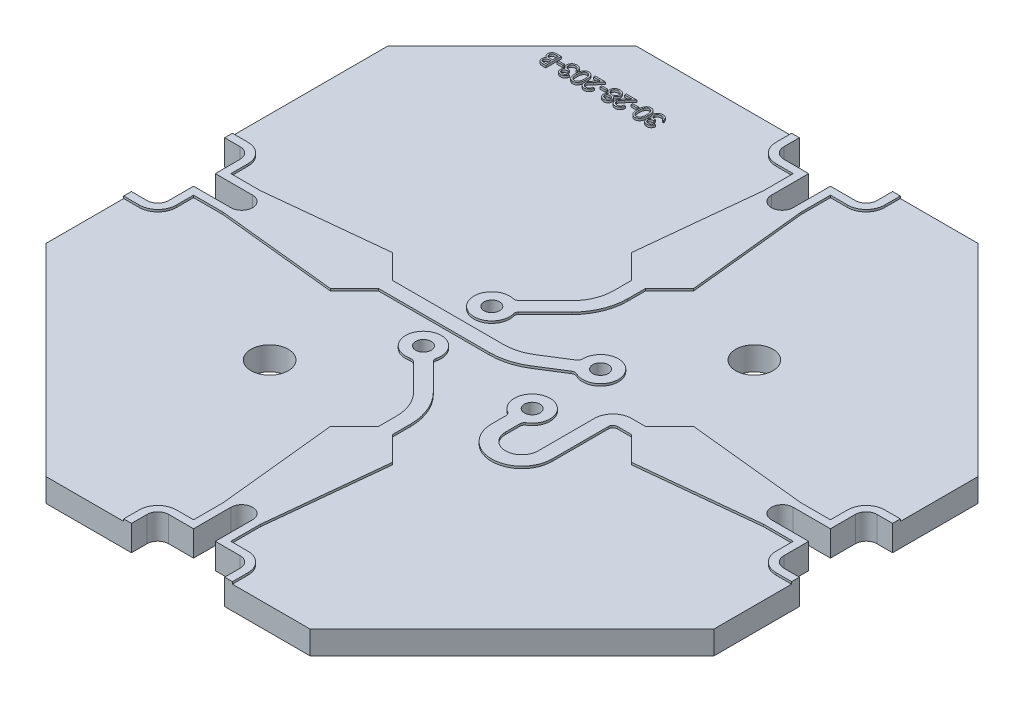
from build123d import *
from build123d.topology import SkipClean

# Parameters (mm, degrees)
SKETCH1_R          = 0.127
SKETCH1_R_2        = 0.3048
SUBSTRATE_DEPTH    = 0.381
BOTTOM_START       = 0.00254
SKETCH3_W          = 5.334
SKETCH3_H          = 5.334
SKETCH3_R          = 0.4064
SKETCH3_R_2        = 0.3048
BOTTOM_TRACE_DEPTH = 0.00254
SKETCH5_R          = 0.127
SKETCH5_W          = 0.097692308
SKETCH5_H          = 0.026051282
SKETCH5_W_2        = 0.097692307
TOP_TRACE_DEPTH    = 0.03556


with BuildPart() as part:
    # Sketch1 → Substrate (new body)
    with BuildSketch(Plane(origin=(0, 0, 0), x_dir=(1, 0, 0), z_dir=(0, 1, 0))):
        with BuildLine():
            Line((-5.461, 3.429), (-5.461, 0.762))
            Line((-5.461, 0.762), (-5.207, 0.762))
            ThreePointArc((-5.207, 0.762), (-5.081276414, 0.709923586), (-5.0292, 0.5842))
            Line((-5.0292, 0.5842), (-5.0292, 0.1778))
            Line((-5.0292, 0.1778), (-4.4196, 0.1778))
            ThreePointArc((-4.4196, 0.1778), (-4.2418, 0), (-4.4196, -0.1778))
            Line((-4.4196, -0.1778), (-5.0292, -0.1778))
            Line((-5.0292, -0.1778), (-5.0292, -0.5842))
            ThreePointArc((-5.0292, -0.5842), (-5.081276414, -0.709923586), (-5.207, -0.762))
            Line((-5.207, -0.762), (-5.461, -0.762))
            Line((-5.461, -0.762), (-5.461, -2.159))
            Line((-5.461, -2.159), (-2.159, -5.461))
            Line((-2.159, -5.461), (-0.762, -5.461))
            Line((-0.762, -5.461), (-0.762, -5.207))
            ThreePointArc((-0.762, -5.207), (-0.709923586, -5.081276414), (-0.5842, -5.0292))
            Line((-0.5842, -5.0292), (-0.1778, -5.0292))
            Line((-0.1778, -5.0292), (-0.1778, -4.4196))
            ThreePointArc((-0.1778, -4.4196), (0, -4.2418), (0.1778, -4.4196))
            Line((0.1778, -4.4196), (0.1778, -5.0292))
            Line((0.1778, -5.0292), (0.5842, -5.0292))
            ThreePointArc((0.5842, -5.0292), (0.709923586, -5.081276414), (0.762, -5.207))
            Line((0.762, -5.207), (0.762, -5.461))
            Line((0.762, -5.461), (2.159, -5.461))
            Line((2.159, -5.461), (5.461, -2.159))
            Line((5.461, -2.159), (5.461, -0.762))
            Line((5.461, -0.762), (5.207, -0.762))
            ThreePointArc((5.207, -0.762), (5.081276414, -0.709923586), (5.0292, -0.5842))
            Line((5.0292, -0.5842), (5.0292, -0.1778))
            Line((5.0292, -0.1778), (4.4196, -0.1778))
            ThreePointArc((4.4196, -0.1778), (4.2418, 0), (4.4196, 0.1778))
            Line((4.4196, 0.1778), (5.0292, 0.1778))
            Line((5.0292, 0.1778), (5.0292, 0.5842))
            ThreePointArc((5.0292, 0.5842), (5.081276414, 0.709923586), (5.207, 0.762))
            Line((5.207, 0.762), (5.461, 0.762))
            Line((5.461, 0.762), (5.461, 2.159))
            Line((5.461, 2.159), (2.159, 5.461))
            Line((2.159, 5.461), (0.762, 5.461))
            Line((0.762, 5.461), (0.762, 5.207))
            ThreePointArc((0.762, 5.207), (0.709923586, 5.081276414), (0.5842, 5.0292))
            Line((0.5842, 5.0292), (0.1778, 5.0292))
            Line((0.1778, 5.0292), (0.1778, 4.4196))
            ThreePointArc((0.1778, 4.4196), (0, 4.2418), (-0.1778, 4.4196))
            Line((-0.1778, 4.4196), (-0.1778, 5.0292))
            Line((-0.1778, 5.0292), (-0.5842, 5.0292))
            ThreePointArc((-0.5842, 5.0292), (-0.709923586, 5.081276414), (-0.762, 5.207))
            Line((-0.762, 5.207), (-0.762, 5.461))
            Line((-0.762, 5.461), (-3.429, 5.461))
            Line((-3.429, 5.461), (-5.461, 3.429))
        make_face()
        with Locations(Location((0.889, 0.5588, 0), (0, 0, 270))):
            Circle(SKETCH1_R, mode=Mode.SUBTRACT)
        with Locations(Location((0.889, -0.5588, 0), (0, 0, 90))):
            Circle(SKETCH1_R, mode=Mode.SUBTRACT)
        with Locations(Location((-0.889, -0.5588, 0), (0, 0, 270))):
            Circle(SKETCH1_R, mode=Mode.SUBTRACT)
        with Locations(Location((-0.889, 0.5588, 0), (0, 0, 90))):
            Circle(SKETCH1_R, mode=Mode.SUBTRACT)
        with Locations(Location((-1.9812, -1.9812, 0), (0, 0, 270))):
            Circle(SKETCH1_R_2, mode=Mode.SUBTRACT)
        with Locations(Location((1.9812, 1.9812, 0), (0, 0, 270))):
            Circle(SKETCH1_R_2, mode=Mode.SUBTRACT)
    extrude(amount=SUBSTRATE_DEPTH)

    # Sketch3 → Bottom trace (add)
    with SkipClean():  # the faces are left unmerged after this step: merging them gives an invalid solid
        with BuildSketch(Plane.XZ.offset(BOTTOM_START)):
            Rectangle(SKETCH3_W, SKETCH3_H)
            with Locations(Location((0.889, -0.5588, 0), (0, 0, 90))):
                Circle(SKETCH3_R, mode=Mode.SUBTRACT)
            with Locations(Location((-0.889, -0.5588, 0), (0, 0, 270))):
                Circle(SKETCH3_R, mode=Mode.SUBTRACT)
            with Locations(Location((-0.889, 0.5588, 0), (0, 0, 90))):
                Circle(SKETCH3_R, mode=Mode.SUBTRACT)
            with Locations(Location((0.889, 0.5588, 0), (0, 0, 270))):
                Circle(SKETCH3_R, mode=Mode.SUBTRACT)
            with Locations(Location((1.9812, -1.9812, 0), (0, 0, 270))):
                Circle(SKETCH3_R_2, mode=Mode.SUBTRACT)
            with Locations(Location((-1.9812, 1.9812, 0), (0, 0, 270))):
                Circle(SKETCH3_R_2, mode=Mode.SUBTRACT)
        extrude(amount=-BOTTOM_TRACE_DEPTH)

    # Sketch5 → Top trace (add)
    # profile 1 of 15: a face of its own
    with SkipClean():  # the faces are left unmerged after this step: merging them gives an invalid solid
        with BuildSketch(Plane(origin=(0, 0.381, 0), x_dir=(-1, 0, 0), z_dir=(0, 1, 0))):
            with BuildLine():
                Line((-1.8415, -0.1143), (-2.070227034, -0.1143))
                Line((-2.070227034, -0.1143), (-2.463800034, -0.507873))
                Line((-2.463800034, -0.507873), (-4.419600034, -0.3048))
                Line((-4.419600034, -0.3048), (-4.902200034, -0.3048))
                Line((-4.902200034, -0.3048), (-4.902200034, -0.5842))
                ThreePointArc((-4.902200034, -0.5842), (-4.991473887, -0.799726147), (-5.207000034, -0.889))
                Line((-5.207000034, -0.889), (-5.461000034, -0.889))
                Line((-5.461000034, -0.889), (-5.461000034, -0.762))
                Line((-5.461000034, -0.762), (-5.207000034, -0.762))
                ThreePointArc((-5.207000034, -0.762), (-5.081276448, -0.709923586), (-5.029200034, -0.5842))
                Line((-5.029200034, -0.5842), (-5.029200034, -0.1778))
                Line((-5.029200034, -0.1778), (-4.419600034, -0.1778))
                ThreePointArc((-4.419600034, -0.1778), (-4.241800047, 2e-08), (-4.419600067, 0.177800007))
                Line((-4.419600067, 0.177800007), (-5.029200067, 0.177800007))
                Line((-5.029200067, 0.177800007), (-5.029200067, 0.584200007))
                ThreePointArc((-5.029200067, 0.584200007), (-5.081276482, 0.709923593), (-5.207000067, 0.762000007))
                Line((-5.207000067, 0.762000007), (-5.461000067, 0.762000007))
                Line((-5.461000067, 0.762000007), (-5.461000067, 0.889000007))
                Line((-5.461000067, 0.889000007), (-5.207000067, 0.889000007))
                ThreePointArc((-5.207000067, 0.889000007), (-4.991473921, 0.799726154), (-4.902200067, 0.584200007))
                Line((-4.902200067, 0.584200007), (-4.902200067, 0.304800007))
                Line((-4.902200067, 0.304800007), (-4.419600067, 0.304800007))
                Line((-4.419600067, 0.304800007), (-2.463800067, 0.507873007))
                Line((-2.463800067, 0.507873007), (-2.070227034, 0.1143))
                Line((-2.070227034, 0.1143), (-1.8415, 0.1143))
                ThreePointArc((-1.8415, 0.1143), (-1.787618463, 0.136618463), (-1.7653, 0.1905))
                Line((-1.7653, 0.1905), (-1.7653, 1.10871))
                ThreePointArc((-1.7653, 1.10871), (-1.27, 1.60401), (-0.7747, 1.10871))
                Line((-0.7747, 1.10871), (-0.7747, 0.8763))
                ThreePointArc((-0.7747, 0.8763), (-0.766332776, 0.840339268), (-0.74295, 0.81176602))
                ThreePointArc((-0.74295, 0.81176602), (-0.889, 0.2667), (-1.03505, 0.81176602))
                ThreePointArc((-1.03505, 0.81176602), (-1.011667224, 0.840339268), (-1.0033, 0.8763))
                Line((-1.0033, 0.8763), (-1.0033, 1.10871))
                ThreePointArc((-1.0033, 1.10871), (-1.27, 1.37541), (-1.5367, 1.10871))
                Line((-1.5367, 1.10871), (-1.5367, 0.1905))
                ThreePointArc((-1.5367, 0.1905), (-1.625973853, -0.025026147), (-1.8415, -0.1143))
            make_face()
            with Locations(Location((-0.889, 0.5588, 0), (0, 0, 270))):
                Circle(SKETCH5_R, mode=Mode.SUBTRACT)
        # profile 2 of 15: a face of its own
        with BuildSketch(Plane(origin=(0, 0.381, 0), x_dir=(-1, 0, 0), z_dir=(0, 1, 0))):
            with BuildLine():
                Line((-0.762, 5.461), (-0.889, 5.461))
                Line((-0.889, 5.461), (-0.889, 5.207))
                ThreePointArc((-0.889, 5.207), (-0.799726147, 4.991473853), (-0.5842, 4.9022))
                Line((-0.5842, 4.9022), (-0.3048, 4.9022))
                Line((-0.3048, 4.9022), (-0.3048, 4.4196))
                Line((-0.3048, 4.4196), (-0.507873, 2.4638))
                Line((-0.507873, 2.4638), (-0.1143, 2.070227))
                Line((-0.1143, 2.070227), (-0.1143, 1.778))
                ThreePointArc((-0.1143, 1.778), (-0.044918225, 1.429194262), (0.152664354, 1.133491036))
                Line((0.152664354, 1.133491036), (0.588822549, 0.697332841))
                ThreePointArc((0.588822549, 0.697332841), (0.605735644, 0.669122151), (0.607360533, 0.636270127))
                ThreePointArc((0.607360533, 0.636270127), (1.09039349, 0.347227147), (0.8255, 0.843914293))
                ThreePointArc((0.8255, 0.843914293), (0.778974738, 0.84639205), (0.73904506, 0.87039955))
                Line((0.73904506, 0.87039955), (0.314308964, 1.295135646))
                ThreePointArc((0.314308964, 1.295135646), (0.166280636, 1.516675695), (0.1143, 1.778))
                Line((0.1143, 1.778), (0.1143, 2.070227))
                Line((0.1143, 2.070227), (0.507873, 2.4638))
                Line((0.507873, 2.4638), (0.3048, 4.4196))
                Line((0.3048, 4.4196), (0.3048, 4.9022))
                Line((0.3048, 4.9022), (0.5842, 4.9022))
                ThreePointArc((0.5842, 4.9022), (0.799726147, 4.991473853), (0.889, 5.207))
                Line((0.889, 5.207), (0.889, 5.461))
                Line((0.889, 5.461), (0.762, 5.461))
                Line((0.762, 5.461), (0.762, 5.207))
                ThreePointArc((0.762, 5.207), (0.709923586, 5.081276414), (0.5842, 5.0292))
                Line((0.5842, 5.0292), (0.1778, 5.0292))
                Line((0.1778, 5.0292), (0.1778, 4.4196))
                ThreePointArc((0.1778, 4.4196), (0, 4.2418), (-0.1778, 4.4196))
                Line((-0.1778, 4.4196), (-0.1778, 5.0292))
                Line((-0.1778, 5.0292), (-0.5842, 5.0292))
                ThreePointArc((-0.5842, 5.0292), (-0.709923586, 5.081276414), (-0.762, 5.207))
                Line((-0.762, 5.207), (-0.762, 5.461))
            make_face()
            with Locations(Location((0.889, 0.5588, 0), (0, 0, 270))):
                Circle(SKETCH5_R, mode=Mode.SUBTRACT)
        # profile 3 of 15: a face of its own
        with BuildSketch(Plane(origin=(0, 0.381, 0), x_dir=(-1, 0, 0), z_dir=(0, 1, 0))):
            with BuildLine():
                Line((-0.762, -5.207), (-0.762, -5.461))
                Line((-0.762, -5.461), (-0.889, -5.461))
                Line((-0.889, -5.461), (-0.889, -5.207))
                ThreePointArc((-0.889, -5.207), (-0.799726147, -4.991473853), (-0.5842, -4.9022))
                Line((-0.5842, -4.9022), (-0.3048, -4.9022))
                Line((-0.3048, -4.9022), (-0.3048, -4.4196))
                Line((-0.3048, -4.4196), (-0.507873, -2.4638))
                Line((-0.507873, -2.4638), (-0.1143, -2.070227))
                Line((-0.1143, -2.070227), (-0.1143, -1.778))
                ThreePointArc((-0.1143, -1.778), (-0.044918225, -1.429194262), (0.152664354, -1.133491036))
                Line((0.152664354, -1.133491036), (0.588822549, -0.697332841))
                ThreePointArc((0.588822549, -0.697332841), (0.605735644, -0.669122151), (0.607360533, -0.636270127))
                ThreePointArc((0.607360533, -0.636270127), (1.09039349, -0.347227147), (0.8255, -0.843914293))
                ThreePointArc((0.8255, -0.843914293), (0.778974738, -0.84639205), (0.73904506, -0.87039955))
                Line((0.73904506, -0.87039955), (0.314308964, -1.295135646))
                ThreePointArc((0.314308964, -1.295135646), (0.166280636, -1.516675695), (0.1143, -1.778))
                Line((0.1143, -1.778), (0.1143, -2.070227))
                Line((0.1143, -2.070227), (0.507873, -2.4638))
                Line((0.507873, -2.4638), (0.3048, -4.4196))
                Line((0.3048, -4.4196), (0.3048, -4.9022))
                Line((0.3048, -4.9022), (0.5842, -4.9022))
                ThreePointArc((0.5842, -4.9022), (0.799726147, -4.991473853), (0.889, -5.207))
                Line((0.889, -5.207), (0.889, -5.461))
                Line((0.889, -5.461), (0.762, -5.461))
                Line((0.762, -5.461), (0.762, -5.207))
                ThreePointArc((0.762, -5.207), (0.709923586, -5.081276414), (0.5842, -5.0292))
                Line((0.5842, -5.0292), (0.1778, -5.0292))
                Line((0.1778, -5.0292), (0.1778, -4.4196))
                ThreePointArc((0.1778, -4.4196), (0, -4.2418), (-0.1778, -4.4196))
                Line((-0.1778, -4.4196), (-0.1778, -5.0292))
                Line((-0.1778, -5.0292), (-0.5842, -5.0292))
                ThreePointArc((-0.5842, -5.0292), (-0.709923586, -5.081276414), (-0.762, -5.207))
            make_face()
            with Locations(Location((0.889, -0.5588, 0), (0, 0, 270))):
                Circle(SKETCH5_R, mode=Mode.SUBTRACT)
        # profile 4 of 15: a face of its own
        with BuildSketch(Plane(origin=(0, 0.381, 0), x_dir=(-1, 0, 0), z_dir=(0, 1, 0))):
            with BuildLine():
                Line((-0.275872891, -0.038401015), (-0.677622318, -0.290929226))
                ThreePointArc((-0.677622318, -0.290929226), (-0.714775082, -0.304006729), (-0.753937077, -0.299801126))
                ThreePointArc((-0.753937077, -0.299801126), (-1.135715109, -0.715177955), (-0.597130737, -0.54719209))
                ThreePointArc((-0.597130737, -0.54719209), (-0.586904072, -0.513669351), (-0.562461007, -0.488551721))
                Line((-0.562461007, -0.488551721), (-0.154218476, -0.23194213))
                ThreePointArc((-0.154218476, -0.23194213), (0.041584137, -0.144297057), (0.254, -0.1143))
                Line((0.254, -0.1143), (2.070227034, -0.1143))
                Line((2.070227034, -0.1143), (2.463800034, -0.507873))
                Line((2.463800034, -0.507873), (4.419600034, -0.3048))
                Line((4.419600034, -0.3048), (4.902200034, -0.3048))
                Line((4.902200034, -0.3048), (4.902200034, -0.5842))
                ThreePointArc((4.902200034, -0.5842), (4.991473887, -0.799726147), (5.207000034, -0.889))
                Line((5.207000034, -0.889), (5.461000034, -0.889))
                Line((5.461000034, -0.889), (5.461000034, -0.762))
                Line((5.461000034, -0.762), (5.207000034, -0.762))
                ThreePointArc((5.207000034, -0.762), (5.081276448, -0.709923586), (5.029200034, -0.5842))
                Line((5.029200034, -0.5842), (5.029200034, -0.1778))
                Line((5.029200034, -0.1778), (4.419600034, -0.1778))
                ThreePointArc((4.419600034, -0.1778), (4.241800034, 0), (4.419600034, 0.1778))
                Line((4.419600034, 0.1778), (5.029200034, 0.1778))
                Line((5.029200034, 0.1778), (5.029200034, 0.5842))
                ThreePointArc((5.029200034, 0.5842), (5.081276448, 0.709923586), (5.207000034, 0.762))
                Line((5.207000034, 0.762), (5.461000034, 0.762))
                Line((5.461000034, 0.762), (5.461000034, 0.889000007))
                Line((5.461000034, 0.889000007), (5.207000067, 0.889000007))
                ThreePointArc((5.207000067, 0.889000007), (4.991473921, 0.799726154), (4.902200067, 0.584200007))
                Line((4.902200067, 0.584200007), (4.902200067, 0.304800007))
                Line((4.902200067, 0.304800007), (4.419600067, 0.304800007))
                Line((4.419600067, 0.304800007), (2.463800067, 0.507873007))
                Line((2.463800067, 0.507873007), (2.070227034, 0.1143))
                Line((2.070227034, 0.1143), (0.254, 0.1143))
                ThreePointArc((0.254, 0.1143), (-0.021718552, 0.07536343), (-0.275872891, -0.038401015))
            make_face()
            with Locations(Location((-0.889, -0.5588, 0), (0, 0, 90))):
                Circle(SKETCH5_R, mode=Mode.SUBTRACT)
        # profile 5 of 15: a face of its own
        with BuildSketch(Plane(origin=(0, 0.381, 0), x_dir=(-1, 0, 0), z_dir=(0, 1, 0))):
            with BuildLine():
                Line((2.14996185, -4.470316637), (2.127166978, -4.470316637))
                add(Edge.make_bspline(
                    [(2.127166978, -4.470316637), (2.127784529, -4.467759765), (2.128991789, -4.46276129), (2.131509841, -4.455619735), (2.134252987, -4.448861628), (2.137546939, -4.442613513), (2.14113986, -4.436749821), (2.145256309, -4.431403548), (2.149706369, -4.426438721), (2.154628523, -4.422032674), (2.159790431, -4.418042862), (2.165264829, -4.414641072), (2.170941576, -4.411714691), (2.176860004, -4.409303851), (2.183037732, -4.407487713), (2.18941891, -4.406170048), (2.196020261, -4.40531435), (2.200501372, -4.405230837), (2.202776754, -4.405188432)],
                    knots=[0, 0, 0, 0, 1.162005537, 2.271625781, 3.343758855, 4.383309926, 5.390229558, 6.379919256, 7.361854164, 8.333198761, 9.295911338, 10.242430842, 11.177959212, 12.116337295, 13.062827104, 14.020064771, 14.994644689, 16, 16, 16, 16], degree=3))
                add(Edge.make_bspline(
                    [(2.202776754, -4.405188432), (2.206092016, -4.405288525), (2.212650224, -4.405486527), (2.222285028, -4.407294603), (2.231576117, -4.410155741), (2.240421794, -4.414108977), (2.248638217, -4.418984857), (2.255948786, -4.424788012), (2.26225441, -4.431406476), (2.267544459, -4.438716782), (2.271686473, -4.446529496), (2.274740741, -4.454570421), (2.276600143, -4.462820485), (2.276841121, -4.46839087), (2.27696185, -4.471181621)],
                    knots=[0, 0, 0, 0, 1.083050992, 2.142477498, 3.193116406, 4.255571735, 5.30263384, 6.308962982, 7.297363603, 8.282367274, 9.249857812, 10.179914175, 11.08814088, 12, 12, 12, 12], degree=3))
                add(Edge.make_bspline(
                    [(2.27696185, -4.471181621), (2.276877407, -4.473867257), (2.276712164, -4.47912263), (2.275309089, -4.48679499), (2.272947886, -4.494026123), (2.269677109, -4.50084647), (2.265443179, -4.507212787), (2.260314361, -4.513139398), (2.254254453, -4.518652588), (2.24966221, -4.521810858), (2.247297988, -4.523436829)],
                    knots=[0, 0, 0, 0, 1.024540389, 2.004866551, 2.965041327, 3.920577974, 4.882998113, 5.874504559, 6.905732034, 8, 8, 8, 8], degree=3))
                add(Edge.make_bspline(
                    [(2.247297988, -4.523436829), (2.24999995, -4.524741531), (2.255353317, -4.527326522), (2.262650413, -4.532396054), (2.269274578, -4.538249401), (2.272968734, -4.542817239), (2.274824831, -4.54511231)],
                    knots=[0, 0, 0, 0, 1.015518401, 2.012035669, 3.001164323, 4, 4, 4, 4], degree=3))
                add(Edge.make_bspline(
                    [(2.274824831, -4.54511231), (2.276047031, -4.546785644), (2.278471417, -4.55010491), (2.281463939, -4.555441554), (2.284178772, -4.560837347), (2.286294245, -4.566436916), (2.287932463, -4.572175357), (2.289103477, -4.578062526), (2.289830944, -4.584103228), (2.289935124, -4.588189905), (2.289987491, -4.590244121)],
                    knots=[0, 0, 0, 0, 1.025084078, 2.033381695, 3.024893161, 4.013698104, 4.991890475, 5.976764909, 6.982997093, 8, 8, 8, 8], degree=3))
                add(Edge.make_bspline(
                    [(2.289987491, -4.590244121), (2.289857261, -4.593800827), (2.289597413, -4.6008975), (2.287274831, -4.611382237), (2.283674328, -4.621631173), (2.278561167, -4.631433747), (2.272329639, -4.640605352), (2.264915936, -4.648811461), (2.256404294, -4.655865303), (2.246911541, -4.661758845), (2.236626927, -4.666470031), (2.22562687, -4.669739914), (2.214069866, -4.671869596), (2.206144536, -4.672097968), (2.202115296, -4.672214073)],
                    knots=[0, 0, 0, 0, 0.955779014, 1.907060117, 2.875433937, 3.871313158, 4.872415639, 5.851225146, 6.836215519, 7.83643374, 8.849228613, 9.86973379, 10.916971861, 12, 12, 12, 12], degree=3))
                add(Edge.make_bspline(
                    [(2.202115296, -4.672214073), (2.199399724, -4.672151066), (2.194056383, -4.672027088), (2.186200998, -4.671179555), (2.178702795, -4.669631606), (2.171551635, -4.667548566), (2.164741167, -4.664907566), (2.158292172, -4.661618723), (2.152164974, -4.657749831), (2.146417393, -4.653255222), (2.141050114, -4.648227376), (2.136205773, -4.642577037), (2.131803605, -4.636408654), (2.127961483, -4.62965058), (2.124504401, -4.622390153), (2.121660983, -4.614534405), (2.119158316, -4.606153565), (2.117994744, -4.60031318), (2.117397748, -4.597316637)],
                    knots=[0, 0, 0, 0, 1.048658725, 2.063410685, 3.046034179, 4.001477787, 4.936774919, 5.862367409, 6.792675028, 7.730719943, 8.675894397, 9.627829632, 10.600096036, 11.597688215, 12.626045268, 13.701542398, 14.82072376, 16, 16, 16, 16], degree=3))
                Line((2.117397748, -4.597316637), (2.140192619, -4.597316637))
                add(Edge.make_bspline(
                    [(2.140192619, -4.597316637), (2.140786492, -4.599272366), (2.141941627, -4.603076427), (2.143907899, -4.608551238), (2.146148054, -4.613570137), (2.148551225, -4.61816994), (2.151075146, -4.622395949), (2.153899258, -4.626136416), (2.15681439, -4.629555634), (2.159011806, -4.631482014), (2.160087251, -4.63242481)],
                    knots=[0, 0, 0, 0, 1.198163088, 2.33053128, 3.407730985, 4.417276592, 5.372219308, 6.28897303, 7.162600585, 8, 8, 8, 8], degree=3))
                add(Edge.make_bspline(
                    [(2.160087251, -4.63242481), (2.161509402, -4.633521244), (2.164349316, -4.635710726), (2.168977067, -4.638504844), (2.173844062, -4.640925901), (2.179055755, -4.64277529), (2.184499684, -4.644341211), (2.190263842, -4.645365958), (2.196297373, -4.646069042), (2.200417091, -4.646131086), (2.202522347, -4.646162791)],
                    knots=[0, 0, 0, 0, 0.946170439, 1.889420265, 2.845303464, 3.807233317, 4.801018734, 5.828864929, 6.890507805, 8, 8, 8, 8], degree=3))
                add(Edge.make_bspline(
                    [(2.202522347, -4.646162791), (2.204899315, -4.646118094), (2.209547272, -4.646030693), (2.216329425, -4.645226913), (2.222781565, -4.644056306), (2.228832057, -4.642248335), (2.234560157, -4.640014524), (2.239885568, -4.637209754), (2.2448782, -4.633919023), (2.249474105, -4.630178753), (2.253606722, -4.626084164), (2.257245418, -4.621801501), (2.260338751, -4.617348821), (2.262834016, -4.612701483), (2.264804371, -4.607878732), (2.266145723, -4.602867035), (2.267078376, -4.597707404), (2.26715433, -4.594200102), (2.267192619, -4.592432022)],
                    knots=[0, 0, 0, 0, 1.217147791, 2.380027433, 3.494444702, 4.572153297, 5.609568379, 6.639424714, 7.649109417, 8.668170816, 9.669597737, 10.625200337, 11.543417969, 12.441394052, 13.322311151, 14.205496177, 15.095365482, 16, 16, 16, 16], degree=3))
                add(Edge.make_bspline(
                    [(2.267192619, -4.592432022), (2.267081563, -4.59006537), (2.266860003, -4.585343844), (2.265168466, -4.578397482), (2.26238616, -4.571704698), (2.25849107, -4.565379677), (2.253749562, -4.559517655), (2.248207652, -4.554287324), (2.241819318, -4.549971495), (2.23593959, -4.546989633), (2.23073149, -4.544954942), (2.226274488, -4.543599673), (2.221284723, -4.542452053), (2.215822537, -4.541384363), (2.209846772, -4.540475671), (2.203363934, -4.539717893), (2.19637271, -4.539111556), (2.191532837, -4.538840785), (2.189038773, -4.538701253)],
                    knots=[0, 0, 0, 0, 1.07054697, 2.135767047, 3.216561865, 4.33974944, 5.486079747, 6.621378074, 7.775625952, 8.963672916, 9.598146892, 10.304877434, 11.070270905, 11.915000392, 12.823868403, 13.805723172, 14.86925407, 16, 16, 16, 16], degree=3))
                Line((2.189038773, -4.538701253), (2.189038773, -4.512649971))
                add(Edge.make_bspline(
                    [(2.189038773, -4.512649971), (2.192181201, -4.512596645), (2.198336444, -4.512492193), (2.207327631, -4.511228869), (2.215925408, -4.509481303), (2.223939235, -4.506804492), (2.231243456, -4.50369551), (2.237580364, -4.500077664), (2.24286118, -4.496056137), (2.24706024, -4.491568856), (2.250219219, -4.486756278), (2.252528935, -4.481740384), (2.253893301, -4.476477209), (2.254075431, -4.47288531), (2.254166978, -4.471079858)],
                    knots=[0, 0, 0, 0, 1.321986639, 2.589447074, 3.816329219, 5.01088745, 6.139805852, 7.153945165, 8.075214402, 8.924034688, 9.728124013, 10.488707548, 11.240355623, 12, 12, 12, 12], degree=3))
                add(Edge.make_bspline(
                    [(2.254166978, -4.471079858), (2.254136904, -4.469753416), (2.254077072, -4.467114523), (2.253322527, -4.463259161), (2.252188668, -4.459521663), (2.250629853, -4.455917925), (2.24854341, -4.452472939), (2.246046519, -4.449157336), (2.243073405, -4.445990045), (2.239666507, -4.443037816), (2.23600805, -4.440224277), (2.231998495, -4.437835687), (2.227758736, -4.43579316), (2.22328408, -4.434108813), (2.218560004, -4.432841768), (2.213608705, -4.431932024), (2.208420742, -4.431363234), (2.204881308, -4.431281343), (2.203082042, -4.431239714)],
                    knots=[0, 0, 0, 0, 0.884392785, 1.759457502, 2.611959086, 3.489218968, 4.37281399, 5.2945488, 6.255912374, 7.266815255, 8.301784654, 9.332968512, 10.37626691, 11.440494194, 12.520033166, 13.637162961, 14.798855837, 16, 16, 16, 16], degree=3))
                add(Edge.make_bspline(
                    [(2.203082042, -4.431239714), (2.20018995, -4.431340687), (2.194541021, -4.431537911), (2.186397424, -4.43326533), (2.178826821, -4.436021454), (2.173040072, -4.439311336), (2.168766879, -4.442558939), (2.165713296, -4.445395203), (2.162714607, -4.448547185), (2.159968092, -4.452209022), (2.157190495, -4.456132726), (2.154661776, -4.460517759), (2.152204529, -4.465249735), (2.150723887, -4.468594961), (2.14996185, -4.470316637)],
                    knots=[0, 0, 0, 0, 1.472543308, 2.876219568, 4.221790263, 5.565193594, 6.249813518, 6.953379497, 7.687249741, 8.463570142, 9.283606569, 10.136032583, 11.040678096, 12, 12, 12, 12], degree=3))
            make_face()
        # profile 6 of 15: a face of its own
        with BuildSketch(Plane(origin=(0, 0.381, 0), x_dir=(-1, 0, 0), z_dir=(0, 1, 0))):
            with BuildLine():
                add(Edge.make_bspline(
                    [(2.312782363, -4.538803015), (2.312806168, -4.534731948), (2.312852409, -4.52682384), (2.313366826, -4.515300612), (2.314221379, -4.504490351), (2.315392491, -4.49439254), (2.316817647, -4.485004572), (2.318720143, -4.476351535), (2.3208837, -4.468393381), (2.323391221, -4.461104158), (2.32622062, -4.454385662), (2.329300135, -4.448113662), (2.33275198, -4.442297647), (2.336378876, -4.43684479), (2.340327638, -4.431844351), (2.344485893, -4.427225712), (2.349015938, -4.423095617), (2.353763779, -4.419333057), (2.358772402, -4.416034724), (2.363899042, -4.413129491), (2.369178984, -4.410647558), (2.374626644, -4.40869608), (2.380193058, -4.407084208), (2.385897685, -4.405981924), (2.391749944, -4.405288365), (2.395700111, -4.405222059), (2.397703437, -4.405188432)],
                    knots=[0, 0, 0, 0, 1.646270934, 3.197905019, 4.663502075, 6.030701355, 7.308322542, 8.50163776, 9.611534131, 10.641858119, 11.616356847, 12.558055219, 13.465016945, 14.349605745, 15.204443733, 16.039544428, 16.859896111, 17.680448484, 18.487036065, 19.28249412, 20.06191084, 20.843045899, 21.620316918, 22.403196591, 23.190181807, 24, 24, 24, 24], degree=3))
                add(Edge.make_bspline(
                    [(2.397703437, -4.405188432), (2.399723497, -4.405223833), (2.403740762, -4.405294236), (2.409680035, -4.405970888), (2.415482097, -4.407093649), (2.421122214, -4.408684486), (2.426646713, -4.410658115), (2.432012383, -4.413131865), (2.437252554, -4.416011418), (2.442283952, -4.419394979), (2.447161813, -4.423167407), (2.451766322, -4.427431898), (2.456097899, -4.432145392), (2.460210907, -4.437257458), (2.463988656, -4.442866147), (2.467586271, -4.448873909), (2.470806413, -4.455385806), (2.47390773, -4.462293188), (2.476584671, -4.469787179), (2.47899885, -4.477825536), (2.480949495, -4.486503206), (2.482574317, -4.495774659), (2.48383306, -4.505673945), (2.484749829, -4.516179843), (2.485234105, -4.527299266), (2.485325305, -4.534901693), (2.485372106, -4.538803015)],
                    knots=[0, 0, 0, 0, 0.810914788, 1.612654377, 2.396697861, 3.181598691, 3.963628158, 4.749916497, 5.551656086, 6.361998678, 7.18212741, 8.025565596, 8.878627764, 9.750805457, 10.657531673, 11.591944965, 12.560506719, 13.57287815, 14.630710178, 15.753379473, 16.941251878, 18.199788006, 19.531962791, 20.947069417, 22.433333509, 24, 24, 24, 24], degree=3))
                add(Edge.make_bspline(
                    [(2.485372106, -4.538803015), (2.48532482, -4.542687322), (2.485232684, -4.550255735), (2.484755258, -4.561325125), (2.483814832, -4.571775269), (2.48263845, -4.581631228), (2.481009151, -4.590851981), (2.479005805, -4.599469436), (2.476781467, -4.607520805), (2.474035742, -4.614940132), (2.471030508, -4.621830914), (2.467760788, -4.628265615), (2.464257778, -4.634301112), (2.460441337, -4.639889094), (2.456373461, -4.645069145), (2.451967084, -4.649749829), (2.447346419, -4.65404393), (2.442454204, -4.657864933), (2.437344337, -4.661209374), (2.432122164, -4.664200322), (2.426695027, -4.666612066), (2.421185915, -4.668682894), (2.415516028, -4.670264984), (2.409692433, -4.671358916), (2.403744752, -4.67212613), (2.399724181, -4.672184657), (2.397703437, -4.672214073)],
                    knots=[0, 0, 0, 0, 1.561518951, 3.042555995, 4.452378317, 5.7783523, 7.031515105, 8.214008947, 9.334062868, 10.386615937, 11.391082383, 12.354592575, 13.286541444, 14.194233754, 15.072674879, 15.931287219, 16.775624067, 17.606195743, 18.42308326, 19.229000347, 20.022332153, 20.807536673, 21.593273796, 22.3848459, 23.188221202, 24, 24, 24, 24], degree=3))
                add(Edge.make_bspline(
                    [(2.397703437, -4.672214073), (2.395700167, -4.672180229), (2.391750109, -4.672113495), (2.385897047, -4.67142307), (2.380215979, -4.670313053), (2.374678869, -4.66875882), (2.369257311, -4.666856372), (2.36402518, -4.66437779), (2.358924303, -4.661523261), (2.353968287, -4.658272393), (2.349250261, -4.654547905), (2.344743677, -4.650428439), (2.340561747, -4.645811198), (2.336669444, -4.640769086), (2.332970182, -4.63534849), (2.329567353, -4.629475403), (2.326419868, -4.62317311), (2.323542883, -4.616400896), (2.320992094, -4.609059939), (2.318738918, -4.601066255), (2.31695989, -4.592349292), (2.315437127, -4.58297906), (2.314208901, -4.572915295), (2.313370387, -4.562152533), (2.312852131, -4.55069748), (2.312806043, -4.542840188), (2.312782363, -4.538803015)],
                    knots=[0, 0, 0, 0, 0.810891512, 1.598919785, 2.382837074, 3.152667961, 3.926044502, 4.706494248, 5.493654104, 6.291793342, 7.103789334, 7.925228297, 8.761435821, 9.622817696, 10.50288917, 11.416980706, 12.369136599, 13.353924996, 14.394355917, 15.514179734, 16.714354668, 17.994756427, 19.357759367, 20.818452758, 22.365282078, 24, 24, 24, 24], degree=3))
            make_face()
            with BuildLine():
                add(Edge.make_bspline(
                    [(2.335577235, -4.538701253), (2.335585903, -4.542093872), (2.335602727, -4.548678281), (2.336042234, -4.558246335), (2.336640965, -4.567170468), (2.337413219, -4.57546201), (2.338560062, -4.583092897), (2.339845069, -4.590115611), (2.341408844, -4.596492987), (2.343259054, -4.602268788), (2.345366463, -4.607541035), (2.347667403, -4.612446952), (2.350139238, -4.617044492), (2.352905599, -4.62129236), (2.355918407, -4.625204407), (2.359109609, -4.628849876), (2.362598305, -4.632100857), (2.367424577, -4.635999891), (2.373796092, -4.640028994), (2.381823977, -4.643537539), (2.390073059, -4.645742437), (2.395672035, -4.646022836), (2.398466658, -4.646162791)],
                    knots=[0, 0, 0, 0, 1.459021318, 2.831673884, 4.118529203, 5.306027144, 6.411944654, 7.436330062, 8.375795394, 9.233974572, 10.042671642, 10.816086306, 11.563610507, 12.285937304, 12.993564865, 13.685989202, 14.367179055, 15.041617293, 16.353048772, 17.594441528, 18.799311195, 20, 20, 20, 20], degree=3))
                add(Edge.make_bspline(
                    [(2.398466658, -4.646162791), (2.401279357, -4.646046838), (2.406898949, -4.645815171), (2.415109231, -4.643580062), (2.42307977, -4.640207701), (2.429326134, -4.636220083), (2.434078296, -4.632422541), (2.437483129, -4.629184792), (2.440608203, -4.625559423), (2.443572171, -4.621647875), (2.446290629, -4.617375414), (2.44876264, -4.612762587), (2.451018403, -4.607796584), (2.452303574, -4.604329866), (2.452960648, -4.602557422)],
                    knots=[0, 0, 0, 0, 1.353760809, 2.704726607, 4.075137775, 5.516104923, 6.260822281, 7.007110065, 7.778089737, 8.566572457, 9.372053459, 10.217411131, 11.088608312, 12, 12, 12, 12], degree=3))
                add(Edge.make_bspline(
                    [(2.452960648, -4.602557422), (2.453726405, -4.600291036), (2.45528122, -4.595689298), (2.457285046, -4.588550908), (2.45886314, -4.581061336), (2.460282882, -4.573265342), (2.461251932, -4.565105432), (2.462031916, -4.556606854), (2.462491343, -4.547763201), (2.462548294, -4.54175465), (2.462577235, -4.538701253)],
                    knots=[0, 0, 0, 0, 0.884706709, 1.796334032, 2.740027952, 3.714592787, 4.726048262, 5.777819803, 6.87074269, 8, 8, 8, 8], degree=3))
                add(Edge.make_bspline(
                    [(2.462577235, -4.538701253), (2.462537307, -4.535648349), (2.462459199, -4.529676216), (2.462160641, -4.52093004), (2.461389673, -4.512622951), (2.460533394, -4.504719162), (2.459270853, -4.497262426), (2.457909572, -4.490190318), (2.456080684, -4.483590453), (2.454127078, -4.4773595), (2.451891123, -4.471568253), (2.44942981, -4.466189709), (2.446801145, -4.461197904), (2.443946022, -4.456606531), (2.440898336, -4.452395027), (2.437577645, -4.448647831), (2.434115671, -4.445248805), (2.429266652, -4.44136895), (2.422918518, -4.437412958), (2.415019434, -4.433772357), (2.406799221, -4.431681698), (2.401242176, -4.431386936), (2.398466658, -4.431239714)],
                    knots=[0, 0, 0, 0, 1.31362396, 2.569729283, 3.763502607, 4.902122613, 5.988968491, 7.01645872, 7.998833611, 8.933434873, 9.825090667, 10.667526885, 11.477055099, 12.250526234, 12.991942729, 13.710640831, 14.402115721, 15.076753259, 16.378508321, 17.609869233, 18.806226677, 20, 20, 20, 20], degree=3))
                add(Edge.make_bspline(
                    [(2.398466658, -4.431239714), (2.395657375, -4.431387139), (2.390033691, -4.431682258), (2.381728039, -4.433764568), (2.373766638, -4.43739408), (2.367435291, -4.441382053), (2.36258289, -4.445180319), (2.359166032, -4.448474078), (2.355962281, -4.452076978), (2.353010968, -4.456025003), (2.350246774, -4.460267918), (2.347708152, -4.464839103), (2.345420895, -4.469761722), (2.343310188, -4.4750316), (2.341454334, -4.480806903), (2.339923515, -4.487176424), (2.338509312, -4.494176801), (2.33750817, -4.501849017), (2.336618171, -4.510142636), (2.336046211, -4.519089047), (2.335601257, -4.528673148), (2.335585402, -4.535291601), (2.335577235, -4.538701253)],
                    knots=[0, 0, 0, 0, 1.207732386, 2.417664972, 3.655092373, 4.956220595, 5.625982001, 6.301752483, 6.994047911, 7.697131622, 8.419323945, 9.170223765, 9.943494443, 10.752040957, 11.610060368, 12.549350801, 13.567764191, 14.679664412, 15.874934091, 17.154273443, 18.533957287, 20, 20, 20, 20], degree=3))
            make_face(mode=Mode.SUBTRACT)
        # profile 7 of 15: a face of its own
        with BuildSketch(Plane(origin=(0, 0.381, 0), x_dir=(-1, 0, 0), z_dir=(0, 1, 0))):
            with Locations((2.557013132, -4.568008945)):
                Rectangle(SKETCH5_W, SKETCH5_H)
        # profile 8 of 15: a face of its own
        with BuildSketch(Plane(origin=(0, 0.381, 0), x_dir=(-1, 0, 0), z_dir=(0, 1, 0))):
            with BuildLine():
                Line((2.65796185, -4.489855099), (2.635166978, -4.489855099))
                add(Edge.make_bspline(
                    [(2.635166978, -4.489855099), (2.635315543, -4.486830983), (2.63560732, -4.4808917), (2.636973716, -4.472232193), (2.638928854, -4.463955074), (2.641693205, -4.4561268), (2.64512629, -4.448678155), (2.649243269, -4.441638725), (2.654119622, -4.435035365), (2.659650054, -4.428929289), (2.665656692, -4.423327677), (2.672137752, -4.41849041), (2.67894822, -4.414403356), (2.686067433, -4.410986604), (2.693575714, -4.40842194), (2.701404927, -4.406518999), (2.70958947, -4.405374087), (2.71516586, -4.405251021), (2.718001914, -4.405188432)],
                    knots=[0, 0, 0, 0, 1.10065271, 2.161652631, 3.183658789, 4.190468796, 5.17591951, 6.163126047, 7.15150782, 8.156236427, 9.156009102, 10.134482811, 11.092018607, 12.041330605, 13.001268258, 13.972401359, 14.968799086, 16, 16, 16, 16], degree=3))
                add(Edge.make_bspline(
                    [(2.718001914, -4.405188432), (2.720787066, -4.405253634), (2.726259789, -4.405381754), (2.734247147, -4.406482012), (2.741850985, -4.408205264), (2.74905644, -4.410623011), (2.755806023, -4.413873081), (2.762150438, -4.417777245), (2.768165217, -4.422292627), (2.773579538, -4.427608761), (2.778551267, -4.43328402), (2.782840402, -4.439342856), (2.786513472, -4.445600639), (2.789575092, -4.452105085), (2.79182888, -4.45891744), (2.793539985, -4.465938523), (2.794507174, -4.473241009), (2.794655613, -4.478183599), (2.794731081, -4.480696445)],
                    knots=[0, 0, 0, 0, 1.111607364, 2.184268762, 3.212621178, 4.221274766, 5.211760367, 6.196651075, 7.1921475, 8.207485113, 9.220403448, 10.201281604, 11.166441695, 12.114753415, 13.065576456, 14.026450734, 14.996634279, 16, 16, 16, 16], degree=3))
                add(Edge.make_bspline(
                    [(2.794731081, -4.480696445), (2.794608198, -4.484234145), (2.79436459, -4.491247463), (2.792280746, -4.501553685), (2.789026171, -4.511539036), (2.785107506, -4.5195754), (2.781154363, -4.526051202), (2.777592012, -4.531382931), (2.773421709, -4.537123728), (2.768582755, -4.543254369), (2.763175249, -4.549822874), (2.757150212, -4.556825277), (2.75046468, -4.564189228), (2.74577232, -4.569218835), (2.743340856, -4.571825051)],
                    knots=[0, 0, 0, 0, 1.184426356, 2.348067706, 3.509069118, 4.696110526, 5.333549288, 6.050745305, 6.844228056, 7.710549037, 8.667450064, 9.695053472, 10.805634456, 12, 12, 12, 12], degree=3))
                Line((2.743340856, -4.571825051), (2.679789975, -4.639649971))
                Line((2.679789975, -4.639649971), (2.797987491, -4.639649971))
                Line((2.797987491, -4.639649971), (2.797987491, -4.665701253))
                Line((2.797987491, -4.665701253), (2.625397748, -4.665701253))
                Line((2.625397748, -4.665701253), (2.723904158, -4.560580259))
                add(Edge.make_bspline(
                    [(2.723904158, -4.560580259), (2.72630249, -4.558076668), (2.730909196, -4.553267781), (2.737424846, -4.546247006), (2.743276932, -4.539733754), (2.748503337, -4.53374033), (2.752990683, -4.528179068), (2.756972839, -4.52323008), (2.760163485, -4.5186759), (2.76362626, -4.51339701), (2.766980074, -4.506951773), (2.769862057, -4.499075328), (2.771619363, -4.490967122), (2.771830171, -4.485487831), (2.771936209, -4.482731701)],
                    knots=[0, 0, 0, 0, 1.329631726, 2.553950428, 3.673215718, 4.687767853, 5.603093632, 6.413772471, 7.123043292, 7.734684054, 8.834405432, 9.900288307, 10.943827018, 12, 12, 12, 12], degree=3))
                add(Edge.make_bspline(
                    [(2.771936209, -4.482731701), (2.771890072, -4.480998594), (2.771799146, -4.477582973), (2.770996673, -4.472575126), (2.769783967, -4.467744422), (2.768046226, -4.463076003), (2.76575248, -4.458616804), (2.762960411, -4.454361398), (2.759738961, -4.450247399), (2.756012326, -4.446389988), (2.751918462, -4.442857124), (2.747593622, -4.439727547), (2.743017986, -4.437112137), (2.738210845, -4.434968124), (2.733185603, -4.433286253), (2.727932538, -4.432120859), (2.722466167, -4.431389159), (2.718733565, -4.431290159), (2.716831642, -4.431239714)],
                    knots=[0, 0, 0, 0, 0.991446411, 1.95395049, 2.89581595, 3.838931463, 4.798493298, 5.75982156, 6.748411868, 7.785213223, 8.824556874, 9.840280684, 10.836137867, 11.835679398, 12.848801643, 13.863922112, 14.911575587, 16, 16, 16, 16], degree=3))
                add(Edge.make_bspline(
                    [(2.716831642, -4.431239714), (2.714845301, -4.431291605), (2.710944457, -4.43139351), (2.70521719, -4.432106355), (2.699753593, -4.433336139), (2.694539924, -4.435018103), (2.68956736, -4.437155952), (2.684860083, -4.439818724), (2.680428662, -4.442996155), (2.676264766, -4.446598641), (2.672428351, -4.45060949), (2.669057635, -4.455080613), (2.666112395, -4.459930374), (2.663542697, -4.465145687), (2.661455855, -4.470773876), (2.659861232, -4.476794961), (2.658599444, -4.483182798), (2.658177911, -4.487594058), (2.65796185, -4.489855099)],
                    knots=[0, 0, 0, 0, 1.031018746, 2.02475058, 2.990194455, 3.934040569, 4.864654155, 5.795059489, 6.735614925, 7.690564532, 8.649604399, 9.611025574, 10.590972636, 11.591080095, 12.624614302, 13.701020113, 14.821632451, 16, 16, 16, 16], degree=3))
            make_face()
        # profile 9 of 15: a face of its own
        with BuildSketch(Plane(origin=(0, 0.381, 0), x_dir=(-1, 0, 0), z_dir=(0, 1, 0))):
            with BuildLine():
                add(Edge.make_bspline(
                    [(2.944271546, -4.524200051), (2.946350612, -4.525284119), (2.950405485, -4.527398416), (2.956180516, -4.530802801), (2.961458274, -4.534390803), (2.966385189, -4.537992948), (2.9708747, -4.541747188), (2.974876609, -4.545668451), (2.978489768, -4.54965886), (2.981641312, -4.553785985), (2.984413311, -4.558038863), (2.986809048, -4.562428656), (2.988856811, -4.566945744), (2.990479722, -4.571639434), (2.991816617, -4.576440779), (2.992736504, -4.581411775), (2.993231218, -4.586519667), (2.993324749, -4.589971767), (2.993372106, -4.591719682)],
                    knots=[0, 0, 0, 0, 1.272397273, 2.481599622, 3.635517121, 4.734568067, 5.792894095, 6.808321871, 7.773003508, 8.711915296, 9.623354172, 10.525449501, 11.423591555, 12.311487226, 13.218079475, 14.126165749, 15.051214107, 16, 16, 16, 16], degree=3))
                add(Edge.make_bspline(
                    [(2.993372106, -4.591719682), (2.993316123, -4.594165175), (2.993205312, -4.599005722), (2.992240113, -4.606150097), (2.990795, -4.613088781), (2.988684658, -4.619820252), (2.985947743, -4.626307366), (2.982574853, -4.632555677), (2.978756783, -4.638667593), (2.975690477, -4.642428201), (2.974138933, -4.64433106)],
                    knots=[0, 0, 0, 0, 1.025265484, 2.029385089, 3.018602448, 3.995076438, 4.983346944, 5.966715145, 6.97116228, 8, 8, 8, 8], degree=3))
                add(Edge.make_bspline(
                    [(2.974138933, -4.64433106), (2.972118801, -4.646551294), (2.968103499, -4.650964326), (2.961224966, -4.656693899), (2.953675949, -4.661508969), (2.945485659, -4.665433044), (2.936675988, -4.668487275), (2.927248814, -4.670682018), (2.917185759, -4.671939131), (2.910269304, -4.672120849), (2.906721065, -4.672214073)],
                    knots=[0, 0, 0, 0, 0.954267603, 1.896743057, 2.838368354, 3.796610408, 4.779680527, 5.799409237, 6.871065594, 8, 8, 8, 8], degree=3))
                add(Edge.make_bspline(
                    [(2.906721065, -4.672214073), (2.903309236, -4.672130436), (2.896670164, -4.671967687), (2.887006706, -4.670865005), (2.877998918, -4.668932583), (2.869594423, -4.666287746), (2.861843889, -4.662847118), (2.854769401, -4.658564793), (2.84826889, -4.65361314), (2.842539632, -4.647849947), (2.837453213, -4.641677176), (2.832985132, -4.635308916), (2.829271356, -4.628744587), (2.826127047, -4.622082067), (2.823719996, -4.615227975), (2.82205287, -4.608217574), (2.820994102, -4.601063109), (2.820853231, -4.596234812), (2.820782363, -4.59380582)],
                    knots=[0, 0, 0, 0, 1.256902934, 2.445805442, 3.576955095, 4.645999104, 5.686449165, 6.692658513, 7.68621702, 8.689161843, 9.678783111, 10.630372946, 11.551080876, 12.453998257, 13.34127905, 14.221779781, 15.105423033, 16, 16, 16, 16], degree=3))
                add(Edge.make_bspline(
                    [(2.820782363, -4.59380582), (2.820824301, -4.592023524), (2.820907184, -4.588501079), (2.82148085, -4.583297031), (2.822403121, -4.578231825), (2.823655665, -4.573286754), (2.825353185, -4.568497818), (2.827402757, -4.563842327), (2.829792676, -4.559315024), (2.83255628, -4.554891151), (2.835771342, -4.550632695), (2.839411789, -4.546467385), (2.843550383, -4.542459856), (2.848141082, -4.538561142), (2.853131423, -4.534702086), (2.858651026, -4.531091242), (2.86455357, -4.527472978), (2.868748591, -4.525309745), (2.870900552, -4.524200051)],
                    knots=[0, 0, 0, 0, 0.941657376, 1.861047343, 2.762797495, 3.66048619, 4.553285746, 5.444104102, 6.34607688, 7.256116206, 8.197091036, 9.162375105, 10.176350973, 11.237807142, 12.343728897, 13.50695164, 14.721116704, 16, 16, 16, 16], degree=3))
                add(Edge.make_bspline(
                    [(2.870900552, -4.524200051), (2.867954778, -4.522593699), (2.862250935, -4.519483352), (2.854698467, -4.513768584), (2.848211262, -4.507579125), (2.842967634, -4.500784277), (2.838840335, -4.493596304), (2.836008699, -4.486060179), (2.834093068, -4.478315638), (2.833903307, -4.473024731), (2.833808004, -4.470367519)],
                    knots=[0, 0, 0, 0, 1.166880483, 2.259407225, 3.286803203, 4.280235371, 5.237608625, 6.161067461, 7.076446754, 8, 8, 8, 8], degree=3))
                add(Edge.make_bspline(
                    [(2.833808004, -4.470367519), (2.833926689, -4.467660781), (2.834165267, -4.462219768), (2.836094456, -4.454120352), (2.839238255, -4.446165321), (2.843514236, -4.438393232), (2.848840051, -4.431067131), (2.855229715, -4.424496445), (2.86253064, -4.418740698), (2.870706382, -4.41390917), (2.879504669, -4.409976984), (2.888787696, -4.407264379), (2.898393721, -4.405491015), (2.904932242, -4.405290235), (2.908247507, -4.405188432)],
                    knots=[0, 0, 0, 0, 0.888701115, 1.786444228, 2.72001202, 3.692817113, 4.693886446, 5.687152267, 6.695133018, 7.739871481, 8.800368666, 9.853104506, 10.91144658, 12, 12, 12, 12], degree=3))
                add(Edge.make_bspline(
                    [(2.908247507, -4.405188432), (2.911477213, -4.405293395), (2.917845824, -4.405500371), (2.927207148, -4.407226618), (2.936164268, -4.410109846), (2.944686294, -4.414021245), (2.952620664, -4.41883904), (2.959631232, -4.424673846), (2.965823939, -4.431215547), (2.970946349, -4.438539427), (2.975167313, -4.446281652), (2.978106522, -4.454382257), (2.979989893, -4.462666218), (2.980227446, -4.46827149), (2.980346465, -4.471079858)],
                    knots=[0, 0, 0, 0, 1.072916533, 2.115669174, 3.151510826, 4.193348718, 5.225979165, 6.227137561, 7.216255879, 8.211077061, 9.189680878, 10.138522389, 11.067357538, 12, 12, 12, 12], degree=3))
                add(Edge.make_bspline(
                    [(2.980346465, -4.471079858), (2.980242357, -4.473835879), (2.980037895, -4.479248547), (2.978317956, -4.487138986), (2.97542139, -4.494528357), (2.971466671, -4.501500508), (2.96631225, -4.507928994), (2.96002693, -4.513895561), (2.952660823, -4.519449222), (2.947126462, -4.522583318), (2.944271546, -4.524200051)],
                    knots=[0, 0, 0, 0, 0.975232327, 1.915300861, 2.843280834, 3.77672583, 4.742871857, 5.749627742, 6.839139064, 8, 8, 8, 8], degree=3))
            make_face()
            with BuildLine():
                add(Edge.make_bspline(
                    [(2.906975472, -4.431239714), (2.905193785, -4.43128699), (2.901708026, -4.431379483), (2.896596917, -4.431862709), (2.891736636, -4.432802743), (2.887076404, -4.434053781), (2.882680113, -4.435743823), (2.878488057, -4.437731918), (2.874571581, -4.440148987), (2.870883406, -4.442860343), (2.867563207, -4.445842513), (2.864616477, -4.448949566), (2.862168779, -4.452242523), (2.860090253, -4.455639473), (2.858582109, -4.459241235), (2.857452585, -4.462937383), (2.856689032, -4.466774625), (2.856631818, -4.469397103), (2.856602876, -4.470723688)],
                    knots=[0, 0, 0, 0, 1.203892937, 2.355340988, 3.463153438, 4.544400666, 5.610487187, 6.640501085, 7.674077295, 8.714426146, 9.728707835, 10.68524104, 11.601827946, 12.495867327, 13.368432065, 14.231010473, 15.105153427, 16, 16, 16, 16], degree=3))
                add(Edge.make_bspline(
                    [(2.856602876, -4.470723688), (2.856652759, -4.472050331), (2.856751335, -4.474671968), (2.857513707, -4.478543353), (2.858649948, -4.482347666), (2.860438881, -4.485994447), (2.862584554, -4.489610199), (2.865232793, -4.493104556), (2.868388854, -4.496489678), (2.871946845, -4.499736774), (2.875822997, -4.502777427), (2.879929382, -4.505417081), (2.884214463, -4.507625727), (2.888634213, -4.509463918), (2.893233677, -4.510892845), (2.897984673, -4.51190657), (2.902887998, -4.512536635), (2.90621036, -4.512611893), (2.907891337, -4.512649971)],
                    knots=[0, 0, 0, 0, 0.873023192, 1.725219244, 2.590779336, 3.480155217, 4.391973325, 5.357036234, 6.360879153, 7.436073238, 8.526419356, 9.601555421, 10.645666583, 11.697338044, 12.750135903, 13.812665442, 14.89329948, 16, 16, 16, 16], degree=3))
                add(Edge.make_bspline(
                    [(2.907891337, -4.512649971), (2.910050345, -4.512586625), (2.914347035, -4.512460561), (2.920681021, -4.511288447), (2.926839625, -4.509444703), (2.932757019, -4.506922123), (2.938280038, -4.503755987), (2.943203288, -4.499965362), (2.947484777, -4.495637775), (2.95108001, -4.490840598), (2.953867468, -4.485735083), (2.956037484, -4.480611519), (2.95730467, -4.475415242), (2.957469956, -4.471934211), (2.957551594, -4.470214874)],
                    knots=[0, 0, 0, 0, 1.076279235, 2.141928126, 3.20205304, 4.278698113, 5.344010996, 6.36967002, 7.368914609, 8.37248503, 9.349703398, 10.264243087, 11.142681841, 12, 12, 12, 12], degree=3))
                add(Edge.make_bspline(
                    [(2.957551594, -4.470214874), (2.957512993, -4.469008154), (2.957436377, -4.466612987), (2.956805001, -4.463075974), (2.955761726, -4.459619427), (2.954349263, -4.456214792), (2.952490723, -4.452909836), (2.950287151, -4.449652606), (2.94761039, -4.446516376), (2.944606192, -4.443428059), (2.941199296, -4.440569904), (2.937396269, -4.438056414), (2.933216609, -4.435921917), (2.928660215, -4.434188276), (2.923743869, -4.432886174), (2.918490215, -4.431911079), (2.912855447, -4.431361488), (2.908977973, -4.431281186), (2.906975472, -4.431239714)],
                    knots=[0, 0, 0, 0, 0.814439003, 1.616544685, 2.417341072, 3.248991801, 4.09997495, 4.973547432, 5.9003056, 6.880240646, 7.880314356, 8.896779544, 9.951930927, 11.043077905, 12.18215768, 13.381699519, 14.647792085, 16, 16, 16, 16], degree=3))
            make_face(mode=Mode.SUBTRACT)
            with BuildLine():
                add(Edge.make_bspline(
                    [(2.908451033, -4.538701253), (2.90619219, -4.538741431), (2.901760892, -4.538820252), (2.895268875, -4.539697604), (2.889038388, -4.540918937), (2.883090438, -4.542771746), (2.877427537, -4.545180863), (2.87201903, -4.54807897), (2.86690629, -4.551504736), (2.862159921, -4.555414639), (2.857825714, -4.559628097), (2.854023094, -4.564088492), (2.850793846, -4.568712927), (2.848193376, -4.573560134), (2.846058924, -4.578527475), (2.844657288, -4.583738655), (2.84375873, -4.589093491), (2.84363807, -4.592733681), (2.843577235, -4.594569041)],
                    knots=[0, 0, 0, 0, 1.140299081, 2.23698856, 3.303958914, 4.344563908, 5.37730929, 6.408454204, 7.439741482, 8.480804886, 9.510774543, 10.48932336, 11.43758569, 12.353841022, 13.263987381, 14.161954604, 15.073269652, 16, 16, 16, 16], degree=3))
                add(Edge.make_bspline(
                    [(2.843577235, -4.594569041), (2.843676168, -4.596850027), (2.84387245, -4.601375449), (2.845429589, -4.608063855), (2.847928625, -4.614538754), (2.851413884, -4.620747382), (2.855729531, -4.626549475), (2.861036423, -4.631606889), (2.867004758, -4.636100619), (2.873836476, -4.639735035), (2.881298885, -4.642637519), (2.889389999, -4.644637295), (2.897993699, -4.645961103), (2.903934366, -4.646094502), (2.906975472, -4.646162791)],
                    knots=[0, 0, 0, 0, 0.898778495, 1.783155532, 2.693654817, 3.627872908, 4.583023416, 5.533784346, 6.509005473, 7.520592997, 8.575161974, 9.658835044, 10.801527049, 12, 12, 12, 12], degree=3))
                add(Edge.make_bspline(
                    [(2.906975472, -4.646162791), (2.909352213, -4.646117158), (2.913982866, -4.646028249), (2.920738247, -4.64524344), (2.927113251, -4.643998867), (2.933095517, -4.642188678), (2.938752013, -4.63997888), (2.943986833, -4.637136106), (2.948934647, -4.633902881), (2.953351643, -4.630066889), (2.95737451, -4.625968091), (2.960882126, -4.621629042), (2.963927046, -4.617167668), (2.966316892, -4.612483147), (2.968227426, -4.607665354), (2.969600735, -4.602669862), (2.970448095, -4.597481351), (2.970533794, -4.593961704), (2.970577235, -4.592177615)],
                    knots=[0, 0, 0, 0, 1.224942928, 2.386581632, 3.501229538, 4.569074225, 5.605009692, 6.626002462, 7.634866581, 8.645888296, 9.63523824, 10.59253846, 11.518950513, 12.414518923, 13.29783783, 14.186679152, 15.080837789, 16, 16, 16, 16], degree=3))
                add(Edge.make_bspline(
                    [(2.970577235, -4.592177615), (2.970511496, -4.590444802), (2.970381871, -4.587027998), (2.969559151, -4.581964942), (2.968113827, -4.577073423), (2.966130639, -4.572294594), (2.96349042, -4.567725283), (2.960381107, -4.563246452), (2.956629591, -4.558982413), (2.952390505, -4.554900045), (2.947770684, -4.551125189), (2.942859982, -4.547785855), (2.937696201, -4.544973559), (2.932290268, -4.542686362), (2.926654185, -4.5408875), (2.920792099, -4.539630853), (2.914697146, -4.538839854), (2.910556592, -4.538747975), (2.908451033, -4.538701253)],
                    knots=[0, 0, 0, 0, 0.917430815, 1.809013306, 2.70690318, 3.612392954, 4.541220862, 5.495268465, 6.494511384, 7.542276156, 8.608045339, 9.649016899, 10.681629292, 11.715607085, 12.752076957, 13.808767841, 14.885711793, 16, 16, 16, 16], degree=3))
            make_face(mode=Mode.SUBTRACT)
        # profile 10 of 15: a face of its own
        with BuildSketch(Plane(origin=(0, 0.381, 0), x_dir=(-1, 0, 0), z_dir=(0, 1, 0))):
            with Locations((3.065013132, -4.568008945)):
                Rectangle(SKETCH5_W, SKETCH5_H)
        # profile 11 of 15: a face of its own
        with BuildSketch(Plane(origin=(0, 0.381, 0), x_dir=(-1, 0, 0), z_dir=(0, 1, 0))):
            with BuildLine():
                Line((3.16596185, -4.489855099), (3.143166978, -4.489855099))
                add(Edge.make_bspline(
                    [(3.143166978, -4.489855099), (3.143315543, -4.486830983), (3.14360732, -4.4808917), (3.144973716, -4.472232193), (3.146928854, -4.463955074), (3.149693205, -4.4561268), (3.15312629, -4.448678155), (3.157243269, -4.441638725), (3.162119622, -4.435035365), (3.167650054, -4.428929289), (3.173656692, -4.423327677), (3.180137752, -4.41849041), (3.18694822, -4.414403356), (3.194067433, -4.410986604), (3.201575714, -4.40842194), (3.209404927, -4.406518999), (3.21758947, -4.405374087), (3.22316586, -4.405251021), (3.226001914, -4.405188432)],
                    knots=[0, 0, 0, 0, 1.10065271, 2.161652631, 3.183658789, 4.190468796, 5.17591951, 6.163126047, 7.15150782, 8.156236427, 9.156009102, 10.134482811, 11.092018607, 12.041330605, 13.001268258, 13.972401359, 14.968799086, 16, 16, 16, 16], degree=3))
                add(Edge.make_bspline(
                    [(3.226001914, -4.405188432), (3.228787066, -4.405253634), (3.234259789, -4.405381754), (3.242247147, -4.406482012), (3.249850985, -4.408205264), (3.25705644, -4.410623011), (3.263806023, -4.413873081), (3.270150438, -4.417777245), (3.276165217, -4.422292627), (3.281579538, -4.427608761), (3.286551267, -4.43328402), (3.290840402, -4.439342856), (3.294513472, -4.445600639), (3.297575092, -4.452105085), (3.29982888, -4.45891744), (3.301539985, -4.465938523), (3.302507174, -4.473241009), (3.302655613, -4.478183599), (3.302731081, -4.480696445)],
                    knots=[0, 0, 0, 0, 1.111607364, 2.184268762, 3.212621178, 4.221274766, 5.211760367, 6.196651075, 7.1921475, 8.207485113, 9.220403448, 10.201281604, 11.166441695, 12.114753415, 13.065576456, 14.026450734, 14.996634279, 16, 16, 16, 16], degree=3))
                add(Edge.make_bspline(
                    [(3.302731081, -4.480696445), (3.302608198, -4.484234145), (3.30236459, -4.491247463), (3.300280746, -4.501553685), (3.297026171, -4.511539036), (3.293107506, -4.5195754), (3.289154363, -4.526051202), (3.285592012, -4.531382931), (3.281421709, -4.537123728), (3.276582755, -4.543254369), (3.271175249, -4.549822874), (3.265150212, -4.556825277), (3.25846468, -4.564189228), (3.25377232, -4.569218835), (3.251340856, -4.571825051)],
                    knots=[0, 0, 0, 0, 1.184426356, 2.348067706, 3.509069118, 4.696110526, 5.333549288, 6.050745305, 6.844228056, 7.710549037, 8.667450064, 9.695053472, 10.805634456, 12, 12, 12, 12], degree=3))
                Line((3.251340856, -4.571825051), (3.187789975, -4.639649971))
                Line((3.187789975, -4.639649971), (3.305987491, -4.639649971))
                Line((3.305987491, -4.639649971), (3.305987491, -4.665701253))
                Line((3.305987491, -4.665701253), (3.133397748, -4.665701253))
                Line((3.133397748, -4.665701253), (3.231904158, -4.560580259))
                add(Edge.make_bspline(
                    [(3.231904158, -4.560580259), (3.23430249, -4.558076668), (3.238909196, -4.553267781), (3.245424846, -4.546247006), (3.251276932, -4.539733754), (3.256503337, -4.53374033), (3.260990683, -4.528179068), (3.264972839, -4.52323008), (3.268163485, -4.5186759), (3.27162626, -4.51339701), (3.274980074, -4.506951773), (3.277862057, -4.499075328), (3.279619363, -4.490967122), (3.279830171, -4.485487831), (3.279936209, -4.482731701)],
                    knots=[0, 0, 0, 0, 1.329631726, 2.553950428, 3.673215718, 4.687767853, 5.603093632, 6.413772471, 7.123043292, 7.734684054, 8.834405432, 9.900288307, 10.943827018, 12, 12, 12, 12], degree=3))
                add(Edge.make_bspline(
                    [(3.279936209, -4.482731701), (3.279890072, -4.480998594), (3.279799146, -4.477582973), (3.278996673, -4.472575126), (3.277783967, -4.467744422), (3.276046226, -4.463076003), (3.27375248, -4.458616804), (3.270960411, -4.454361398), (3.267738961, -4.450247399), (3.264012326, -4.446389988), (3.259918462, -4.442857124), (3.255593622, -4.439727547), (3.251017986, -4.437112137), (3.246210845, -4.434968124), (3.241185603, -4.433286253), (3.235932538, -4.432120859), (3.230466167, -4.431389159), (3.226733565, -4.431290159), (3.224831642, -4.431239714)],
                    knots=[0, 0, 0, 0, 0.991446411, 1.95395049, 2.89581595, 3.838931463, 4.798493298, 5.75982156, 6.748411868, 7.785213223, 8.824556874, 9.840280684, 10.836137867, 11.835679398, 12.848801643, 13.863922112, 14.911575587, 16, 16, 16, 16], degree=3))
                add(Edge.make_bspline(
                    [(3.224831642, -4.431239714), (3.222845301, -4.431291605), (3.218944457, -4.43139351), (3.21321719, -4.432106355), (3.207753593, -4.433336139), (3.202539924, -4.435018103), (3.19756736, -4.437155952), (3.192860083, -4.439818724), (3.188428662, -4.442996155), (3.184264766, -4.446598641), (3.180428351, -4.45060949), (3.177057635, -4.455080613), (3.174112395, -4.459930374), (3.171542697, -4.465145687), (3.169455855, -4.470773876), (3.167861232, -4.476794961), (3.166599444, -4.483182798), (3.166177911, -4.487594058), (3.16596185, -4.489855099)],
                    knots=[0, 0, 0, 0, 1.031018746, 2.02475058, 2.990194455, 3.934040569, 4.864654155, 5.795059489, 6.735614925, 7.690564532, 8.649604399, 9.611025574, 10.590972636, 11.591080095, 12.624614302, 13.701020113, 14.821632451, 16, 16, 16, 16], degree=3))
            make_face()
        # profile 12 of 15: a face of its own
        with BuildSketch(Plane(origin=(0, 0.381, 0), x_dir=(-1, 0, 0), z_dir=(0, 1, 0))):
            with BuildLine():
                add(Edge.make_bspline(
                    [(3.328782363, -4.538803015), (3.328806168, -4.534731948), (3.328852409, -4.52682384), (3.329366826, -4.515300612), (3.330221379, -4.504490351), (3.331392491, -4.49439254), (3.332817647, -4.485004572), (3.334720143, -4.476351535), (3.3368837, -4.468393381), (3.339391221, -4.461104158), (3.34222062, -4.454385662), (3.345300135, -4.448113662), (3.34875198, -4.442297647), (3.352378876, -4.43684479), (3.356327638, -4.431844351), (3.360485893, -4.427225712), (3.365015938, -4.423095617), (3.369763779, -4.419333057), (3.374772402, -4.416034724), (3.379899042, -4.413129491), (3.385178984, -4.410647558), (3.390626644, -4.40869608), (3.396193058, -4.407084208), (3.401897685, -4.405981924), (3.407749944, -4.405288365), (3.411700111, -4.405222059), (3.413703437, -4.405188432)],
                    knots=[0, 0, 0, 0, 1.646270934, 3.197905019, 4.663502075, 6.030701355, 7.308322542, 8.50163776, 9.611534131, 10.641858119, 11.616356847, 12.558055219, 13.465016945, 14.349605745, 15.204443733, 16.039544428, 16.859896111, 17.680448484, 18.487036065, 19.28249412, 20.06191084, 20.843045899, 21.620316918, 22.403196591, 23.190181807, 24, 24, 24, 24], degree=3))
                add(Edge.make_bspline(
                    [(3.413703437, -4.405188432), (3.415723497, -4.405223833), (3.419740762, -4.405294236), (3.425680035, -4.405970888), (3.431482097, -4.407093649), (3.437122214, -4.408684486), (3.442646713, -4.410658115), (3.448012383, -4.413131865), (3.453252554, -4.416011418), (3.458283952, -4.419394979), (3.463161813, -4.423167407), (3.467766322, -4.427431898), (3.472097899, -4.432145392), (3.476210907, -4.437257458), (3.479988656, -4.442866147), (3.483586271, -4.448873909), (3.486806413, -4.455385806), (3.48990773, -4.462293188), (3.492584671, -4.469787179), (3.49499885, -4.477825536), (3.496949495, -4.486503206), (3.498574317, -4.495774659), (3.49983306, -4.505673945), (3.500749829, -4.516179843), (3.501234105, -4.527299266), (3.501325305, -4.534901693), (3.501372106, -4.538803015)],
                    knots=[0, 0, 0, 0, 0.810914788, 1.612654377, 2.396697861, 3.181598691, 3.963628158, 4.749916497, 5.551656086, 6.361998678, 7.18212741, 8.025565596, 8.878627764, 9.750805457, 10.657531673, 11.591944965, 12.560506719, 13.57287815, 14.630710178, 15.753379473, 16.941251878, 18.199788006, 19.531962791, 20.947069417, 22.433333509, 24, 24, 24, 24], degree=3))
                add(Edge.make_bspline(
                    [(3.501372106, -4.538803015), (3.50132482, -4.542687322), (3.501232684, -4.550255735), (3.500755258, -4.561325125), (3.499814832, -4.571775269), (3.49863845, -4.581631228), (3.497009151, -4.590851981), (3.495005805, -4.599469436), (3.492781467, -4.607520805), (3.490035742, -4.614940132), (3.487030508, -4.621830914), (3.483760788, -4.628265615), (3.480257778, -4.634301112), (3.476441337, -4.639889094), (3.472373461, -4.645069145), (3.467967084, -4.649749829), (3.463346419, -4.65404393), (3.458454204, -4.657864933), (3.453344337, -4.661209374), (3.448122164, -4.664200322), (3.442695027, -4.666612066), (3.437185915, -4.668682894), (3.431516028, -4.670264984), (3.425692433, -4.671358916), (3.419744752, -4.67212613), (3.415724181, -4.672184657), (3.413703437, -4.672214073)],
                    knots=[0, 0, 0, 0, 1.561518951, 3.042555995, 4.452378317, 5.7783523, 7.031515105, 8.214008947, 9.334062868, 10.386615937, 11.391082383, 12.354592575, 13.286541444, 14.194233754, 15.072674879, 15.931287219, 16.775624067, 17.606195743, 18.42308326, 19.229000347, 20.022332153, 20.807536673, 21.593273796, 22.3848459, 23.188221202, 24, 24, 24, 24], degree=3))
                add(Edge.make_bspline(
                    [(3.413703437, -4.672214073), (3.411700167, -4.672180229), (3.407750109, -4.672113495), (3.401897047, -4.67142307), (3.396215979, -4.670313053), (3.390678869, -4.66875882), (3.385257311, -4.666856372), (3.38002518, -4.66437779), (3.374924303, -4.661523261), (3.369968287, -4.658272393), (3.365250261, -4.654547905), (3.360743677, -4.650428439), (3.356561747, -4.645811198), (3.352669444, -4.640769086), (3.348970182, -4.63534849), (3.345567353, -4.629475403), (3.342419868, -4.62317311), (3.339542883, -4.616400896), (3.336992094, -4.609059939), (3.334738918, -4.601066255), (3.33295989, -4.592349292), (3.331437127, -4.58297906), (3.330208901, -4.572915295), (3.329370387, -4.562152533), (3.328852131, -4.55069748), (3.328806043, -4.542840188), (3.328782363, -4.538803015)],
                    knots=[0, 0, 0, 0, 0.810891512, 1.598919785, 2.382837074, 3.152667961, 3.926044502, 4.706494248, 5.493654104, 6.291793342, 7.103789334, 7.925228297, 8.761435821, 9.622817696, 10.50288917, 11.416980706, 12.369136599, 13.353924996, 14.394355917, 15.514179734, 16.714354668, 17.994756427, 19.357759367, 20.818452758, 22.365282078, 24, 24, 24, 24], degree=3))
            make_face()
            with BuildLine():
                add(Edge.make_bspline(
                    [(3.351577235, -4.538701253), (3.351585903, -4.542093872), (3.351602727, -4.548678281), (3.352042234, -4.558246335), (3.352640965, -4.567170468), (3.353413219, -4.57546201), (3.354560062, -4.583092897), (3.355845069, -4.590115611), (3.357408844, -4.596492987), (3.359259054, -4.602268788), (3.361366463, -4.607541035), (3.363667403, -4.612446952), (3.366139238, -4.617044492), (3.368905599, -4.62129236), (3.371918407, -4.625204407), (3.375109609, -4.628849876), (3.378598305, -4.632100857), (3.383424577, -4.635999891), (3.389796092, -4.640028994), (3.397823977, -4.643537539), (3.406073059, -4.645742437), (3.411672035, -4.646022836), (3.414466658, -4.646162791)],
                    knots=[0, 0, 0, 0, 1.459021318, 2.831673884, 4.118529203, 5.306027144, 6.411944654, 7.436330062, 8.375795394, 9.233974572, 10.042671642, 10.816086306, 11.563610507, 12.285937304, 12.993564865, 13.685989202, 14.367179055, 15.041617293, 16.353048772, 17.594441528, 18.799311195, 20, 20, 20, 20], degree=3))
                add(Edge.make_bspline(
                    [(3.414466658, -4.646162791), (3.417279357, -4.646046838), (3.422898949, -4.645815171), (3.431109231, -4.643580062), (3.43907977, -4.640207701), (3.445326134, -4.636220083), (3.450078296, -4.632422541), (3.453483129, -4.629184792), (3.456608203, -4.625559423), (3.459572171, -4.621647875), (3.462290629, -4.617375414), (3.46476264, -4.612762587), (3.467018403, -4.607796584), (3.468303574, -4.604329866), (3.468960648, -4.602557422)],
                    knots=[0, 0, 0, 0, 1.353760809, 2.704726607, 4.075137775, 5.516104923, 6.260822281, 7.007110065, 7.778089737, 8.566572457, 9.372053459, 10.217411131, 11.088608312, 12, 12, 12, 12], degree=3))
                add(Edge.make_bspline(
                    [(3.468960648, -4.602557422), (3.469726405, -4.600291036), (3.47128122, -4.595689298), (3.473285046, -4.588550908), (3.47486314, -4.581061336), (3.476282882, -4.573265342), (3.477251932, -4.565105432), (3.478031916, -4.556606854), (3.478491343, -4.547763201), (3.478548294, -4.54175465), (3.478577235, -4.538701253)],
                    knots=[0, 0, 0, 0, 0.884706709, 1.796334032, 2.740027952, 3.714592787, 4.726048262, 5.777819803, 6.87074269, 8, 8, 8, 8], degree=3))
                add(Edge.make_bspline(
                    [(3.478577235, -4.538701253), (3.478537307, -4.535648349), (3.478459199, -4.529676216), (3.478160641, -4.52093004), (3.477389673, -4.512622951), (3.476533394, -4.504719162), (3.475270853, -4.497262426), (3.473909572, -4.490190318), (3.472080684, -4.483590453), (3.470127078, -4.4773595), (3.467891123, -4.471568253), (3.46542981, -4.466189709), (3.462801145, -4.461197904), (3.459946022, -4.456606531), (3.456898336, -4.452395027), (3.453577645, -4.448647831), (3.450115671, -4.445248805), (3.445266652, -4.44136895), (3.438918518, -4.437412958), (3.431019434, -4.433772357), (3.422799221, -4.431681698), (3.417242176, -4.431386936), (3.414466658, -4.431239714)],
                    knots=[0, 0, 0, 0, 1.31362396, 2.569729283, 3.763502607, 4.902122613, 5.988968491, 7.01645872, 7.998833611, 8.933434873, 9.825090667, 10.667526885, 11.477055099, 12.250526234, 12.991942729, 13.710640831, 14.402115721, 15.076753259, 16.378508321, 17.609869233, 18.806226677, 20, 20, 20, 20], degree=3))
                add(Edge.make_bspline(
                    [(3.414466658, -4.431239714), (3.411657375, -4.431387139), (3.406033691, -4.431682258), (3.397728039, -4.433764568), (3.389766638, -4.43739408), (3.383435291, -4.441382053), (3.37858289, -4.445180319), (3.375166032, -4.448474078), (3.371962281, -4.452076978), (3.369010968, -4.456025003), (3.366246774, -4.460267918), (3.363708152, -4.464839103), (3.361420895, -4.469761722), (3.359310188, -4.4750316), (3.357454334, -4.480806903), (3.355923515, -4.487176424), (3.354509312, -4.494176801), (3.35350817, -4.501849017), (3.352618171, -4.510142636), (3.352046211, -4.519089047), (3.351601257, -4.528673148), (3.351585402, -4.535291601), (3.351577235, -4.538701253)],
                    knots=[0, 0, 0, 0, 1.207732386, 2.417664972, 3.655092373, 4.956220595, 5.625982001, 6.301752483, 6.994047911, 7.697131622, 8.419323945, 9.170223765, 9.943494443, 10.752040957, 11.610060368, 12.549350801, 13.567764191, 14.679664412, 15.874934091, 17.154273443, 18.533957287, 20, 20, 20, 20], degree=3))
            make_face(mode=Mode.SUBTRACT)
        # profile 13 of 15: a face of its own
        with BuildSketch(Plane(origin=(0, 0.381, 0), x_dir=(-1, 0, 0), z_dir=(0, 1, 0))):
            with BuildLine():
                Line((3.556731081, -4.470316637), (3.533936209, -4.470316637))
                add(Edge.make_bspline(
                    [(3.533936209, -4.470316637), (3.534553759, -4.467759765), (3.53576102, -4.46276129), (3.538279072, -4.455619735), (3.541022218, -4.448861628), (3.54431617, -4.442613513), (3.547909091, -4.436749821), (3.55202554, -4.431403548), (3.5564756, -4.426438721), (3.561397753, -4.422032674), (3.566559662, -4.418042862), (3.57203406, -4.414641072), (3.577710807, -4.411714691), (3.583629235, -4.409303851), (3.589806962, -4.407487713), (3.596188141, -4.406170048), (3.602789492, -4.40531435), (3.607270603, -4.405230837), (3.609545985, -4.405188432)],
                    knots=[0, 0, 0, 0, 1.162005537, 2.271625781, 3.343758855, 4.383309926, 5.390229558, 6.379919256, 7.361854164, 8.333198761, 9.295911338, 10.242430842, 11.177959212, 12.116337295, 13.062827104, 14.020064771, 14.994644689, 16, 16, 16, 16], degree=3))
                add(Edge.make_bspline(
                    [(3.609545985, -4.405188432), (3.612861247, -4.405288525), (3.619419455, -4.405486527), (3.629054259, -4.407294603), (3.638345348, -4.410155741), (3.647191025, -4.414108977), (3.655407448, -4.418984857), (3.662718017, -4.424788012), (3.66902364, -4.431406476), (3.67431369, -4.438716782), (3.678455704, -4.446529496), (3.681509972, -4.454570421), (3.683369374, -4.462820485), (3.683610352, -4.46839087), (3.683731081, -4.471181621)],
                    knots=[0, 0, 0, 0, 1.083050992, 2.142477498, 3.193116406, 4.255571735, 5.30263384, 6.308962982, 7.297363603, 8.282367274, 9.249857812, 10.179914175, 11.08814088, 12, 12, 12, 12], degree=3))
                add(Edge.make_bspline(
                    [(3.683731081, -4.471181621), (3.683646637, -4.473867257), (3.683481395, -4.47912263), (3.68207832, -4.48679499), (3.679717117, -4.494026123), (3.67644634, -4.50084647), (3.67221241, -4.507212787), (3.667083592, -4.513139398), (3.661023684, -4.518652588), (3.656431441, -4.521810858), (3.654067219, -4.523436829)],
                    knots=[0, 0, 0, 0, 1.024540389, 2.004866551, 2.965041327, 3.920577974, 4.882998113, 5.874504559, 6.905732034, 8, 8, 8, 8], degree=3))
                add(Edge.make_bspline(
                    [(3.654067219, -4.523436829), (3.65676918, -4.524741531), (3.662122548, -4.527326522), (3.669419643, -4.532396054), (3.676043809, -4.538249401), (3.679737965, -4.542817239), (3.681594062, -4.54511231)],
                    knots=[0, 0, 0, 0, 1.015518401, 2.012035669, 3.001164323, 4, 4, 4, 4], degree=3))
                add(Edge.make_bspline(
                    [(3.681594062, -4.54511231), (3.682816262, -4.546785644), (3.685240648, -4.55010491), (3.68823317, -4.555441554), (3.690948003, -4.560837347), (3.693063476, -4.566436916), (3.694701693, -4.572175357), (3.695872708, -4.578062526), (3.696600174, -4.584103228), (3.696704355, -4.588189905), (3.696756722, -4.590244121)],
                    knots=[0, 0, 0, 0, 1.025084078, 2.033381695, 3.024893161, 4.013698104, 4.991890475, 5.976764909, 6.982997093, 8, 8, 8, 8], degree=3))
                add(Edge.make_bspline(
                    [(3.696756722, -4.590244121), (3.696626491, -4.593800827), (3.696366644, -4.6008975), (3.694044062, -4.611382237), (3.690443558, -4.621631173), (3.685330398, -4.631433747), (3.67909887, -4.640605352), (3.671685167, -4.648811461), (3.663173525, -4.655865303), (3.653680772, -4.661758845), (3.643396158, -4.666470031), (3.6323961, -4.669739914), (3.620839096, -4.671869596), (3.612913767, -4.672097968), (3.608884526, -4.672214073)],
                    knots=[0, 0, 0, 0, 0.955779014, 1.907060117, 2.875433937, 3.871313158, 4.872415639, 5.851225146, 6.836215519, 7.83643374, 8.849228613, 9.86973379, 10.916971861, 12, 12, 12, 12], degree=3))
                add(Edge.make_bspline(
                    [(3.608884526, -4.672214073), (3.606168954, -4.672151066), (3.600825614, -4.672027088), (3.592970229, -4.671179555), (3.585472025, -4.669631606), (3.578320866, -4.667548566), (3.571510398, -4.664907566), (3.565061403, -4.661618723), (3.558934205, -4.657749831), (3.553186624, -4.653255222), (3.547819345, -4.648227376), (3.542975004, -4.642577037), (3.538572836, -4.636408654), (3.534730713, -4.62965058), (3.531273632, -4.622390153), (3.528430214, -4.614534405), (3.525927547, -4.606153565), (3.524763975, -4.60031318), (3.524166978, -4.597316637)],
                    knots=[0, 0, 0, 0, 1.048658725, 2.063410685, 3.046034179, 4.001477787, 4.936774919, 5.862367409, 6.792675028, 7.730719943, 8.675894397, 9.627829632, 10.600096036, 11.597688215, 12.626045268, 13.701542398, 14.82072376, 16, 16, 16, 16], degree=3))
                Line((3.524166978, -4.597316637), (3.54696185, -4.597316637))
                add(Edge.make_bspline(
                    [(3.54696185, -4.597316637), (3.547555723, -4.599272366), (3.548710858, -4.603076427), (3.55067713, -4.608551238), (3.552917285, -4.613570137), (3.555320455, -4.61816994), (3.557844377, -4.622395949), (3.560668489, -4.626136416), (3.563583621, -4.629555634), (3.565781037, -4.631482014), (3.566856481, -4.63242481)],
                    knots=[0, 0, 0, 0, 1.198163088, 2.33053128, 3.407730985, 4.417276592, 5.372219308, 6.28897303, 7.162600585, 8, 8, 8, 8], degree=3))
                add(Edge.make_bspline(
                    [(3.566856481, -4.63242481), (3.568278633, -4.633521244), (3.571118546, -4.635710726), (3.575746298, -4.638504844), (3.580613293, -4.640925901), (3.585824986, -4.64277529), (3.591268915, -4.644341211), (3.597033072, -4.645365958), (3.603066604, -4.646069042), (3.607186322, -4.646131086), (3.609291578, -4.646162791)],
                    knots=[0, 0, 0, 0, 0.946170439, 1.889420265, 2.845303464, 3.807233317, 4.801018734, 5.828864929, 6.890507805, 8, 8, 8, 8], degree=3))
                add(Edge.make_bspline(
                    [(3.609291578, -4.646162791), (3.611668546, -4.646118094), (3.616316503, -4.646030693), (3.623098655, -4.645226913), (3.629550796, -4.644056306), (3.635601288, -4.642248335), (3.641329388, -4.640014524), (3.646654799, -4.637209754), (3.651647431, -4.633919023), (3.656243336, -4.630178753), (3.660375953, -4.626084164), (3.664014649, -4.621801501), (3.667107982, -4.617348821), (3.669603247, -4.612701483), (3.671573601, -4.607878732), (3.672914954, -4.602867035), (3.673847606, -4.597707404), (3.673923561, -4.594200102), (3.67396185, -4.592432022)],
                    knots=[0, 0, 0, 0, 1.217147791, 2.380027433, 3.494444702, 4.572153297, 5.609568379, 6.639424714, 7.649109417, 8.668170816, 9.669597737, 10.625200337, 11.543417969, 12.441394052, 13.322311151, 14.205496177, 15.095365482, 16, 16, 16, 16], degree=3))
                add(Edge.make_bspline(
                    [(3.67396185, -4.592432022), (3.673850794, -4.59006537), (3.673629234, -4.585343844), (3.671937697, -4.578397482), (3.669155391, -4.571704698), (3.6652603, -4.565379677), (3.660518793, -4.559517655), (3.654976883, -4.554287324), (3.648588548, -4.549971495), (3.642708821, -4.546989633), (3.637500721, -4.544954942), (3.633043719, -4.543599673), (3.628053954, -4.542452053), (3.622591767, -4.541384363), (3.616616002, -4.540475671), (3.610133165, -4.539717893), (3.603141941, -4.539111556), (3.598302068, -4.538840785), (3.595808004, -4.538701253)],
                    knots=[0, 0, 0, 0, 1.07054697, 2.135767047, 3.216561865, 4.33974944, 5.486079747, 6.621378074, 7.775625952, 8.963672916, 9.598146892, 10.304877434, 11.070270905, 11.915000392, 12.823868403, 13.805723172, 14.86925407, 16, 16, 16, 16], degree=3))
                Line((3.595808004, -4.538701253), (3.595808004, -4.512649971))
                add(Edge.make_bspline(
                    [(3.595808004, -4.512649971), (3.598950431, -4.512596645), (3.605105675, -4.512492193), (3.614096862, -4.511228869), (3.622694639, -4.509481303), (3.630708465, -4.506804492), (3.638012686, -4.50369551), (3.644349595, -4.500077664), (3.64963041, -4.496056137), (3.653829471, -4.491568856), (3.656988449, -4.486756278), (3.659298166, -4.481740384), (3.660662532, -4.476477209), (3.660844662, -4.47288531), (3.660936209, -4.471079858)],
                    knots=[0, 0, 0, 0, 1.321986639, 2.589447074, 3.816329219, 5.01088745, 6.139805852, 7.153945165, 8.075214402, 8.924034688, 9.728124013, 10.488707548, 11.240355623, 12, 12, 12, 12], degree=3))
                add(Edge.make_bspline(
                    [(3.660936209, -4.471079858), (3.660906135, -4.469753416), (3.660846303, -4.467114523), (3.660091758, -4.463259161), (3.658957899, -4.459521663), (3.657399084, -4.455917925), (3.655312641, -4.452472939), (3.65281575, -4.449157336), (3.649842636, -4.445990045), (3.646435738, -4.443037816), (3.642777281, -4.440224277), (3.638767726, -4.437835687), (3.634527967, -4.43579316), (3.63005331, -4.434108813), (3.625329235, -4.432841768), (3.620377936, -4.431932024), (3.615189973, -4.431363234), (3.611650539, -4.431281343), (3.609851273, -4.431239714)],
                    knots=[0, 0, 0, 0, 0.884392785, 1.759457502, 2.611959086, 3.489218968, 4.37281399, 5.2945488, 6.255912374, 7.266815255, 8.301784654, 9.332968512, 10.37626691, 11.440494194, 12.520033166, 13.637162961, 14.798855837, 16, 16, 16, 16], degree=3))
                add(Edge.make_bspline(
                    [(3.609851273, -4.431239714), (3.606959181, -4.431340687), (3.601310251, -4.431537911), (3.593166655, -4.43326533), (3.585596051, -4.436021454), (3.579809303, -4.439311336), (3.57553611, -4.442558939), (3.572482527, -4.445395203), (3.569483838, -4.448547185), (3.566737323, -4.452209022), (3.563959726, -4.456132726), (3.561431006, -4.460517759), (3.55897376, -4.465249735), (3.557493118, -4.468594961), (3.556731081, -4.470316637)],
                    knots=[0, 0, 0, 0, 1.472543308, 2.876219568, 4.221790263, 5.565193594, 6.249813518, 6.953379497, 7.687249741, 8.463570142, 9.283606569, 10.136032583, 11.040678096, 12, 12, 12, 12], degree=3))
            make_face()
        # profile 14 of 15: a face of its own
        with BuildSketch(Plane(origin=(0, 0.381, 0), x_dir=(-1, 0, 0), z_dir=(0, 1, 0))):
            with Locations((3.768397748, -4.568008945)):
                Rectangle(SKETCH5_W_2, SKETCH5_H)
        # profile 15 of 15: a face of its own
        with BuildSketch(Plane(origin=(0, 0.381, 0), x_dir=(-1, 0, 0), z_dir=(0, 1, 0))):
            with BuildLine():
                Line((3.859577235, -4.411701253), (3.909135728, -4.411701253))
                add(Edge.make_bspline(
                    [(3.909135728, -4.411701253), (3.911561681, -4.411714007), (3.91626378, -4.411738728), (3.92310142, -4.412122133), (3.929505762, -4.412644913), (3.935478664, -4.413474411), (3.941017367, -4.4144753), (3.946138561, -4.415687375), (3.950825962, -4.417140735), (3.956422143, -4.419451865), (3.962802671, -4.422886175), (3.969711355, -4.427960991), (3.975618977, -4.434168204), (3.980712498, -4.441170088), (3.984762065, -4.448872513), (3.987691723, -4.457091894), (3.989546494, -4.465722215), (3.989737243, -4.471647177), (3.989833645, -4.474641557)],
                    knots=[0, 0, 0, 0, 1.001505555, 1.941167018, 2.826882275, 3.653841531, 4.429895133, 5.150066043, 5.825578002, 6.45369114, 7.647487171, 8.808567382, 9.977351308, 11.170798116, 12.373658725, 13.556498008, 14.765093433, 16, 16, 16, 16], degree=3))
                add(Edge.make_bspline(
                    [(3.989833645, -4.474641557), (3.989754309, -4.477446628), (3.989598405, -4.482958858), (3.988107588, -4.491021116), (3.985773642, -4.498695633), (3.982529318, -4.5059544), (3.978312773, -4.512633411), (3.973315627, -4.518786544), (3.967286624, -4.524153278), (3.962769544, -4.527153591), (3.960475071, -4.528677615)],
                    knots=[0, 0, 0, 0, 1.044552857, 2.05264487, 3.044412934, 4.028983338, 5.005914585, 5.980388656, 6.974128949, 8, 8, 8, 8], degree=3))
                add(Edge.make_bspline(
                    [(3.960475071, -4.528677615), (3.963360542, -4.529785418), (3.968881163, -4.531904919), (3.976478377, -4.535652178), (3.983023945, -4.539727943), (3.988568195, -4.544178883), (3.993309842, -4.548976493), (3.997450256, -4.554191122), (4.000983133, -4.559890792), (4.004010299, -4.566016077), (4.006372409, -4.572504432), (4.008141403, -4.579294997), (4.009155041, -4.586363422), (4.009299287, -4.591173846), (4.009372106, -4.593602294)],
                    knots=[0, 0, 0, 0, 1.27268992, 2.434971085, 3.483601985, 4.442670788, 5.356604649, 6.2567628, 7.179492994, 8.113709626, 9.066344395, 10.018646069, 10.999752585, 12, 12, 12, 12], degree=3))
                add(Edge.make_bspline(
                    [(4.009372106, -4.593602294), (4.009301215, -4.596081833), (4.009161735, -4.600960395), (4.008132674, -4.608127196), (4.006390299, -4.614976121), (4.003990279, -4.621551468), (4.000857928, -4.627840518), (3.997045899, -4.633850395), (3.992500636, -4.639520715), (3.987416074, -4.644914486), (3.981663907, -4.649764274), (3.975457906, -4.654083414), (3.968719916, -4.6576355), (3.9615606, -4.660619348), (3.953899647, -4.662898614), (3.945771458, -4.664493195), (3.937183043, -4.665567617), (3.931289535, -4.665655952), (3.928267139, -4.665701253)],
                    knots=[0, 0, 0, 0, 0.978564426, 1.925352924, 2.850884081, 3.763762016, 4.682927383, 5.618979971, 6.567305752, 7.547517671, 8.540179244, 9.531824382, 10.526200242, 11.540722885, 12.589160233, 13.674978461, 14.80764778, 16, 16, 16, 16], degree=3))
                Line((3.928267139, -4.665701253), (3.859577235, -4.665701253))
                Line((3.859577235, -4.665701253), (3.859577235, -4.411701253))
            make_face()
            with BuildLine():
                Line((3.882372106, -4.437752535), (3.882372106, -4.519162791))
                Line((3.882372106, -4.519162791), (3.897687411, -4.519162791))
                add(Edge.make_bspline(
                    [(3.897687411, -4.519162791), (3.899926152, -4.519133768), (3.904251856, -4.51907769), (3.910516214, -4.518917052), (3.916331001, -4.518467251), (3.92168618, -4.518017579), (3.926573318, -4.517286452), (3.930981586, -4.516416166), (3.93498017, -4.51549575), (3.939591326, -4.513930421), (3.944821763, -4.511617013), (3.950397651, -4.508026771), (3.955313238, -4.503750547), (3.95946412, -4.498816345), (3.962861295, -4.493383199), (3.965220862, -4.487537797), (3.966820865, -4.481425822), (3.966965393, -4.477229869), (3.967038773, -4.47509949)],
                    knots=[0, 0, 0, 0, 1.156816544, 2.235205308, 3.236616184, 4.169592532, 5.011045266, 5.787822928, 6.49130361, 7.128639758, 8.301311294, 9.436451833, 10.541879658, 11.654887649, 12.756523258, 13.837046038, 14.901820046, 16, 16, 16, 16], degree=3))
                add(Edge.make_bspline(
                    [(3.967038773, -4.47509949), (3.967000588, -4.473689734), (3.966925682, -4.470924343), (3.966312214, -4.466893047), (3.965269539, -4.463101644), (3.963930284, -4.459498174), (3.962058762, -4.456195314), (3.959855242, -4.453078865), (3.957192909, -4.450254957), (3.954162521, -4.44761557), (3.950678467, -4.445275539), (3.946742825, -4.443226066), (3.942302348, -4.441575736), (3.937431872, -4.440130392), (3.932056427, -4.439115242), (3.926238045, -4.438269539), (3.919929069, -4.437838991), (3.915564253, -4.437781996), (3.913308004, -4.437752535)],
                    knots=[0, 0, 0, 0, 0.91205012, 1.789085906, 2.630437955, 3.453916878, 4.269457761, 5.079663411, 5.91843418, 6.774407191, 7.675494373, 8.627863946, 9.638891023, 10.736472738, 11.911756761, 13.175263542, 14.539845004, 16, 16, 16, 16], degree=3))
                Line((3.913308004, -4.437752535), (3.882372106, -4.437752535))
            make_face(mode=Mode.SUBTRACT)
            with BuildLine():
                Line((3.882372106, -4.545214073), (3.882372106, -4.639649971))
                Line((3.882372106, -4.639649971), (3.914834446, -4.639649971))
                add(Edge.make_bspline(
                    [(3.914834446, -4.639649971), (3.917158105, -4.639622121), (3.921636652, -4.639568446), (3.928102856, -4.639393218), (3.93409603, -4.638994636), (3.939588826, -4.638367194), (3.944640556, -4.637686587), (3.949190618, -4.636771368), (3.953275895, -4.635722786), (3.958012945, -4.634101964), (3.963347199, -4.631583991), (3.969095644, -4.627787473), (3.974206576, -4.623264582), (3.978546729, -4.618029938), (3.982103671, -4.612338065), (3.984691239, -4.606304088), (3.986287147, -4.60002771), (3.986480344, -4.595748411), (3.986577235, -4.593602294)],
                    knots=[0, 0, 0, 0, 1.160039823, 2.235823828, 3.228722157, 4.157150951, 4.99529583, 5.772374946, 6.472645482, 7.099169577, 8.269452708, 9.405989375, 10.527446681, 11.663510218, 12.788923519, 13.866172445, 14.929861265, 16, 16, 16, 16], degree=3))
                add(Edge.make_bspline(
                    [(3.986577235, -4.593602294), (3.986557197, -4.592260206), (3.986517446, -4.589597678), (3.985917961, -4.58568493), (3.985046098, -4.581894824), (3.983918959, -4.578217068), (3.982277432, -4.574718154), (3.980361072, -4.571328882), (3.978114158, -4.568044773), (3.97461301, -4.563892798), (3.969520529, -4.559109106), (3.962284666, -4.554425527), (3.954057077, -4.550648344), (3.94808971, -4.549044553), (3.945007123, -4.548216076)],
                    knots=[0, 0, 0, 0, 0.723448775, 1.435228256, 2.130040452, 2.821711965, 3.505591119, 4.210454504, 4.921174351, 5.648778258, 7.137944449, 8.670945889, 10.280296675, 12, 12, 12, 12], degree=3))
                add(Edge.make_bspline(
                    [(3.945007123, -4.548216076), (3.943771297, -4.547965336), (3.941091771, -4.547421679), (3.936722421, -4.546847806), (3.931734161, -4.546336536), (3.926115472, -4.545958354), (3.919859246, -4.545567445), (3.912952121, -4.545415421), (3.905422305, -4.545234046), (3.900197715, -4.545220901), (3.897483885, -4.545214073)],
                    knots=[0, 0, 0, 0, 0.634451884, 1.375622551, 2.216452059, 3.157844607, 4.20941857, 5.370758133, 6.634282058, 8, 8, 8, 8], degree=3))
                Line((3.897483885, -4.545214073), (3.882372106, -4.545214073))
            make_face(mode=Mode.SUBTRACT)
        extrude(amount=TOP_TRACE_DEPTH)


solid = part.part
